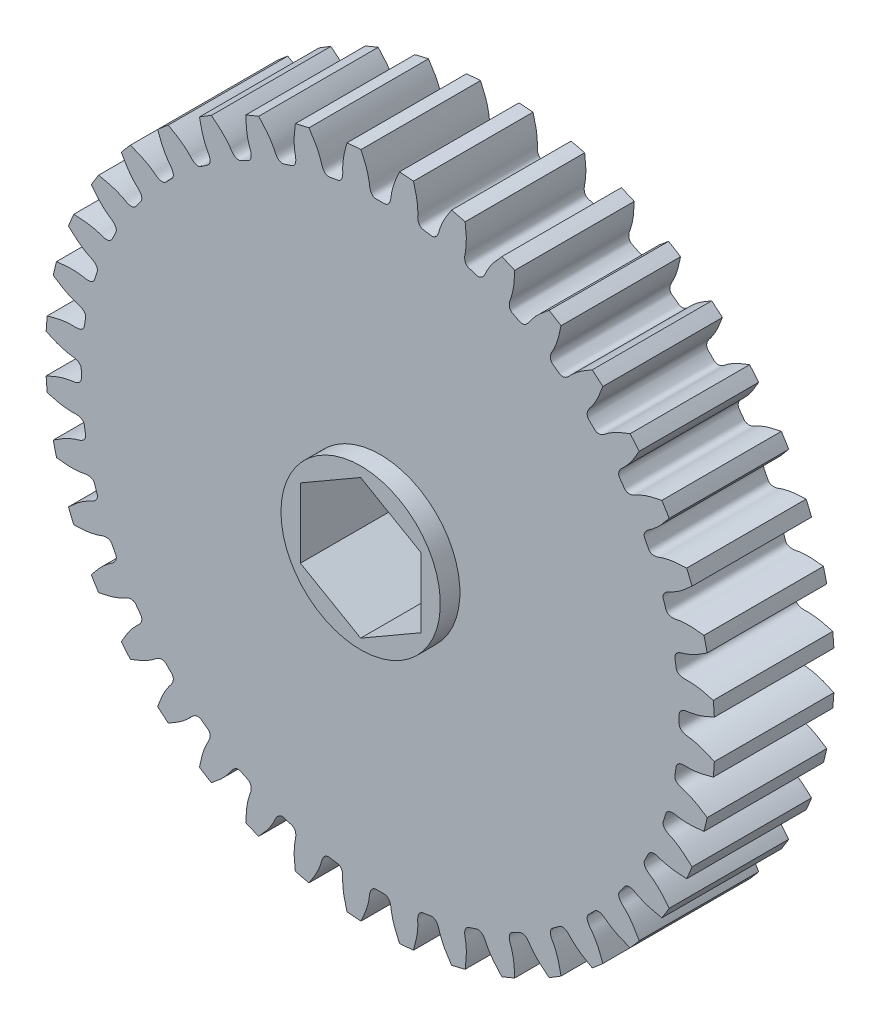
from build123d import *

# Parameters (mm, degrees)
BOSS_EXTRUDE1_DEPTH = 9.525
SKETCH2_R           = 6.35
BOSS_EXTRUDE2_DEPTH = 1.5621
BOSS_EXTRUDE3_START = 1.5621
SKETCH3_R           = 6.35
BOSS_EXTRUDE3_DEPTH = 1.5621
CUT_EXTRUDE1_DEPTH  = 40.722420689


with BuildPart() as part:
    # Sketch1 → Boss-Extrude1 (new body)
    with BuildSketch(Plane(origin=(0, 0, -4.7625), x_dir=(-1, 0, 0), z_dir=(0, 0, -1))):
        with BuildLine():
            ThreePointArc((-25.796844139, 6.768436486), (-25.933105777, 6.225987854), (-26.057962294, 5.680801095))
            add(Edge.make_bspline(
                [(-26.538058921, 2.649590288), (-26.346435583, 2.708405668), (-26.095635845, 2.777592561), (-25.787565675, 2.84804005), (-25.623095813, 2.882036671), (-25.468603865, 2.910607439), (-25.324240561, 2.934186764), (-25.190142623, 2.953213264), (-25.06643285, 2.968128812), (-24.953219968, 2.979378698), (-24.850598663, 2.987409714), (-24.758649208, 2.992674564), (-24.677438402, 2.995616326), (-24.607016458, 2.996714746), (-24.54742621, 2.996345626), (-24.481053639, 2.994767032), (-24.422080222, 2.990385038), (-24.36698261, 2.987604644), (-24.330087377, 2.986413555), (-24.294043161, 2.985903027), (-24.25881806, 2.986082526), (-24.22437529, 2.986955025), (-24.1906708, 2.988531322), (-24.157652377, 2.990828084), (-24.125258084, 2.993870672), (-24.093414571, 2.997695491), (-24.062035097, 3.002353509), (-24.031017368, 3.007914921), (-24.000241282, 3.014475479), (-23.969566905, 3.022165081), (-23.938833278, 3.031159397), (-23.90785924, 3.04169547), (-23.87644845, 3.054092242), (-23.844402438, 3.06877652), (-23.81154811, 3.08631336), (-23.77778938, 3.107435856), (-23.743196072, 3.133060919), (-23.708138554, 3.164262644), (-23.673470271, 3.202155715), (-23.640667386, 3.247631948), (-23.611960583, 3.30093819), (-23.590578681, 3.358597809), (-23.561503956, 3.501074849), (-23.536937958, 3.727884745), (-23.490213498, 3.951185086), (-23.473837378, 4.095673388), (-23.476354973, 4.157118315), (-23.48718423, 4.216686454), (-23.504328699, 4.27007357), (-23.525590593, 4.316825112), (-23.549290411, 4.357333084), (-23.574272021, 4.392393888), (-23.599851272, 4.422914596), (-23.625678413, 4.449745667), (-23.65161829, 4.473614008), (-23.677660913, 4.495110506), (-23.703863148, 4.514702412), (-23.730313168, 4.532753728), (-23.757110016, 4.549545878), (-23.784352489, 4.565295672), (-23.812133532, 4.580169895), (-23.840537778, 4.594296724), (-23.869640825, 4.60777453), (-23.899509416, 4.62067859), (-23.930202064, 4.633066195), (-23.961769837, 4.644980602), (-23.994257241, 4.656453799), (-24.027702834, 4.667509668), (-24.062140682, 4.678162403), (-24.097598201, 4.688430863), (-24.150858333, 4.70281265), (-24.208299496, 4.716868914), (-24.271911375, 4.735877835), (-24.328699133, 4.75394118), (-24.39533495, 4.776747417), (-24.471661963, 4.804640718), (-24.557484163, 4.838061832), (-24.652601103, 4.877411509), (-24.756796547, 4.923095491), (-24.869842375, 4.975509442), (-24.991497581, 5.035043262), (-25.121508829, 5.102079246), (-25.25961055, 5.176992299), (-25.405525151, 5.260148989), (-25.676747823, 5.42234745), (-25.893892621, 5.565649477), (-26.057962294, 5.680801095)],
                knots=[0, 0, 0, 0, 0.085621698, 0.111077756, 0.134991023, 0.157361498, 0.178189182, 0.197474075, 0.215216176, 0.231415486, 0.246072005, 0.259185732, 0.270756668, 0.280784812, 0.289270165, 0.296212727, 0.309141565, 0.314524909, 0.319779282, 0.324910023, 0.3299233, 0.334826267, 0.339627264, 0.344336062, 0.34896417, 0.353525211, 0.358035401, 0.362514142, 0.366984759, 0.37147542, 0.376020255, 0.380660689, 0.38544696, 0.390439674, 0.395711073, 0.401345277, 0.407436134, 0.414080402, 0.421363225, 0.429333468, 0.437970745, 0.447155355, 0.455484445, 0.5, 0.544515555, 0.552844645, 0.562029255, 0.570666532, 0.578636775, 0.585919598, 0.592563866, 0.598654723, 0.604288927, 0.609560326, 0.61455304, 0.619339311, 0.623979745, 0.62852458, 0.633015241, 0.637485858, 0.641964599, 0.646474789, 0.65103583, 0.655663938, 0.660372736, 0.665173733, 0.6700767, 0.675089977, 0.680220718, 0.685475091, 0.690858435, 0.703787273, 0.710729835, 0.719215188, 0.729243332, 0.740814268, 0.753927995, 0.768584514, 0.784783824, 0.802525925, 0.821810818, 0.842638502, 0.865008977, 0.888922244, 0.914378302, 1, 1, 1, 1], degree=3))
            ThreePointArc((-26.538058921, 2.649590288), (-26.587785291, 2.092504083), (-26.625818618, 1.534497615))
            add(Edge.make_bspline(
                [(-26.625818618, -1.534497615), (-26.445755233, -1.446429856), (-26.208866471, -1.338861045), (-25.915609572, -1.22108809), (-25.758482849, -1.161781269), (-25.610362406, -1.109394389), (-25.471465074, -1.063521969), (-25.341994504, -1.023752177), (-25.222141109, -0.989667792), (-25.112081935, -0.960846015), (-25.011980397, -0.936860365), (-24.921986596, -0.91727627), (-24.842235822, -0.901666557), (-24.772852721, -0.889565241), (-24.713938384, -0.880607849), (-24.648136023, -0.871784049), (-24.589203172, -0.866886619), (-24.534348953, -0.861013616), (-24.497721634, -0.856418355), (-24.462041319, -0.85128404), (-24.427277977, -0.84559633), (-24.393395743, -0.839346537), (-24.360352799, -0.832517104), (-24.32810018, -0.825083399), (-24.296580681, -0.817010686), (-24.265727547, -0.808251534), (-24.235463081, -0.798742033), (-24.205697228, -0.788396849), (-24.176326345, -0.777102622), (-24.147232539, -0.764709162), (-24.118284315, -0.751017783), (-24.089339823, -0.735766019), (-24.060255035, -0.718608142), (-24.03090069, -0.69909155), (-24.00119422, -0.676631069), (-23.971155401, -0.650487598), (-23.940996638, -0.619766436), (-23.911251761, -0.583464652), (-23.882938084, -0.540614792), (-23.857653107, -0.490566946), (-23.837638666, -0.433426259), (-23.825539963, -0.373131659), (-23.819111516, -0.227860459), (-23.83032885, 0), (-23.819111516, 0.227860459), (-23.825539963, 0.373131659), (-23.837638666, 0.433426259), (-23.857653107, 0.490566946), (-23.882938084, 0.540614792), (-23.911251761, 0.583464652), (-23.940996638, 0.619766436), (-23.971155401, 0.650487598), (-24.00119422, 0.676631069), (-24.03090069, 0.69909155), (-24.060255035, 0.718608142), (-24.089339823, 0.735766019), (-24.118284315, 0.751017783), (-24.147232539, 0.764709162), (-24.176326345, 0.777102622), (-24.205697228, 0.788396849), (-24.235463081, 0.798742033), (-24.265727547, 0.808251534), (-24.296580681, 0.817010686), (-24.32810018, 0.825083399), (-24.360352799, 0.832517104), (-24.393395743, 0.839346537), (-24.427277977, 0.84559633), (-24.462041319, 0.85128404), (-24.497721634, 0.856418355), (-24.534348953, 0.861013616), (-24.589203172, 0.866886619), (-24.648136023, 0.871784049), (-24.713938384, 0.880607849), (-24.772852721, 0.889565241), (-24.842235822, 0.901666557), (-24.921986596, 0.91727627), (-25.011980397, 0.936860365), (-25.112081935, 0.960846015), (-25.222141109, 0.989667792), (-25.341994504, 1.023752177), (-25.471465074, 1.063521969), (-25.610362406, 1.109394389), (-25.758482849, 1.161781269), (-25.915609572, 1.22108809), (-26.208866471, 1.338861045), (-26.445755233, 1.446429856), (-26.625818618, 1.534497615)],
                knots=[0, 0, 0, 0, 0.085621698, 0.111077756, 0.134991023, 0.157361498, 0.178189182, 0.197474075, 0.215216176, 0.231415486, 0.246072005, 0.259185732, 0.270756668, 0.280784812, 0.289270165, 0.296212727, 0.309141565, 0.314524909, 0.319779282, 0.324910023, 0.3299233, 0.334826267, 0.339627264, 0.344336062, 0.34896417, 0.353525211, 0.358035401, 0.362514142, 0.366984759, 0.37147542, 0.376020255, 0.380660689, 0.38544696, 0.390439674, 0.395711073, 0.401345277, 0.407436134, 0.414080402, 0.421363225, 0.429333468, 0.437970745, 0.447155355, 0.455484445, 0.5, 0.544515555, 0.552844645, 0.562029255, 0.570666532, 0.578636775, 0.585919598, 0.592563866, 0.598654723, 0.604288927, 0.609560326, 0.61455304, 0.619339311, 0.623979745, 0.62852458, 0.633015241, 0.637485858, 0.641964599, 0.646474789, 0.65103583, 0.655663938, 0.660372736, 0.665173733, 0.6700767, 0.675089977, 0.680220718, 0.685475091, 0.690858435, 0.703787273, 0.710729835, 0.719215188, 0.729243332, 0.740814268, 0.753927995, 0.768584514, 0.784783824, 0.802525925, 0.821810818, 0.842638502, 0.865008977, 0.888922244, 0.914378302, 1, 1, 1, 1], degree=3))
            ThreePointArc((-26.625818618, -1.534497615), (-26.587785291, -2.092504083), (-26.538058921, -2.649590288))
            add(Edge.make_bspline(
                [(-26.057962294, -5.680801095), (-25.893892621, -5.565649477), (-25.676747823, -5.42234745), (-25.405525151, -5.260148989), (-25.25961055, -5.176992299), (-25.121508829, -5.102079246), (-24.991497581, -5.035043262), (-24.869842375, -4.975509442), (-24.756796547, -4.923095491), (-24.652601103, -4.877411509), (-24.557484163, -4.838061832), (-24.471661963, -4.804640718), (-24.39533495, -4.776747417), (-24.328699133, -4.75394118), (-24.271911375, -4.735877835), (-24.208299496, -4.716868914), (-24.150858333, -4.70281265), (-24.097598201, -4.688430863), (-24.062140682, -4.678162403), (-24.027702834, -4.667509668), (-23.994257241, -4.656453799), (-23.961769837, -4.644980602), (-23.930202064, -4.633066195), (-23.899509416, -4.62067859), (-23.869640825, -4.60777453), (-23.840537778, -4.594296724), (-23.812133532, -4.580169895), (-23.784352489, -4.565295672), (-23.757110016, -4.549545878), (-23.730313168, -4.532753728), (-23.703863148, -4.514702412), (-23.677660913, -4.495110506), (-23.65161829, -4.473614008), (-23.625678413, -4.449745667), (-23.599851272, -4.422914596), (-23.574272021, -4.392393888), (-23.549290411, -4.357333084), (-23.525590593, -4.316825112), (-23.504328699, -4.27007357), (-23.48718423, -4.216686454), (-23.476354973, -4.157118315), (-23.473837378, -4.095673388), (-23.490213498, -3.951185086), (-23.536937958, -3.727884745), (-23.561503956, -3.501074849), (-23.590578681, -3.358597809), (-23.611960583, -3.30093819), (-23.640667386, -3.247631948), (-23.673470271, -3.202155715), (-23.708138554, -3.164262644), (-23.743196072, -3.133060919), (-23.77778938, -3.107435856), (-23.81154811, -3.08631336), (-23.844402438, -3.06877652), (-23.87644845, -3.054092242), (-23.90785924, -3.04169547), (-23.938833278, -3.031159397), (-23.969566905, -3.022165081), (-24.000241282, -3.014475479), (-24.031017368, -3.007914921), (-24.062035097, -3.002353509), (-24.093414571, -2.997695491), (-24.125258084, -2.993870672), (-24.157652377, -2.990828084), (-24.1906708, -2.988531322), (-24.22437529, -2.986955025), (-24.25881806, -2.986082526), (-24.294043161, -2.985903027), (-24.330087377, -2.986413555), (-24.36698261, -2.987604644), (-24.422080222, -2.990385038), (-24.481053639, -2.994767032), (-24.54742621, -2.996345626), (-24.607016458, -2.996714746), (-24.677438402, -2.995616326), (-24.758649208, -2.992674564), (-24.850598663, -2.987409714), (-24.953219968, -2.979378698), (-25.06643285, -2.968128812), (-25.190142623, -2.953213264), (-25.324240561, -2.934186764), (-25.468603865, -2.910607439), (-25.623095813, -2.882036671), (-25.787565675, -2.84804005), (-26.095635845, -2.777592561), (-26.346435583, -2.708405668), (-26.538058921, -2.649590288)],
                knots=[0, 0, 0, 0, 0.085621698, 0.111077756, 0.134991023, 0.157361498, 0.178189182, 0.197474075, 0.215216176, 0.231415486, 0.246072005, 0.259185732, 0.270756668, 0.280784812, 0.289270165, 0.296212727, 0.309141565, 0.314524909, 0.319779282, 0.324910023, 0.3299233, 0.334826267, 0.339627264, 0.344336062, 0.34896417, 0.353525211, 0.358035401, 0.362514142, 0.366984759, 0.37147542, 0.376020255, 0.380660689, 0.38544696, 0.390439674, 0.395711073, 0.401345277, 0.407436134, 0.414080402, 0.421363225, 0.429333468, 0.437970745, 0.447155355, 0.455484445, 0.5, 0.544515555, 0.552844645, 0.562029255, 0.570666532, 0.578636775, 0.585919598, 0.592563866, 0.598654723, 0.604288927, 0.609560326, 0.61455304, 0.619339311, 0.623979745, 0.62852458, 0.633015241, 0.637485858, 0.641964599, 0.646474789, 0.65103583, 0.655663938, 0.660372736, 0.665173733, 0.6700767, 0.675089977, 0.680220718, 0.685475091, 0.690858435, 0.703787273, 0.710729835, 0.719215188, 0.729243332, 0.740814268, 0.753927995, 0.768584514, 0.784783824, 0.802525925, 0.821810818, 0.842638502, 0.865008977, 0.888922244, 0.914378302, 1, 1, 1, 1], degree=3))
            ThreePointArc((-26.057962294, -5.680801095), (-25.933105777, -6.225987854), (-25.796844139, -6.768436486))
            add(Edge.make_bspline(
                [(-24.848472457, -9.687224398), (-24.704436436, -9.547824336), (-24.512382426, -9.372317665), (-24.269872385, -9.169687562), (-24.138762808, -9.064728596), (-24.014080331, -8.969133978), (-23.896156475, -8.882585078), (-23.785312188, -8.804753152), (-23.681857491, -8.73530024), (-23.586091415, -8.673878946), (-23.498301168, -8.620134161), (-23.418763795, -8.573698966), (-23.347739969, -8.534208902), (-23.28549223, -8.501259309), (-23.232229353, -8.474534791), (-23.172374293, -8.445808812), (-23.117839209, -8.422939826), (-23.067484605, -8.400403382), (-23.034069969, -8.384714566), (-23.001722563, -8.368805718), (-22.970418259, -8.352653921), (-22.940125632, -8.336239828), (-22.910810335, -8.31953382), (-22.882433413, -8.30249734), (-22.854951194, -8.285079672), (-22.828314846, -8.267215081), (-22.802470227, -8.248818774), (-22.777358056, -8.229781765), (-22.752914794, -8.209964215), (-22.72907473, -8.189186854), (-22.705774202, -8.167220084), (-22.682959409, -8.143770455), (-22.660600207, -8.118464651), (-22.638713524, -8.090832278), (-22.617401662, -8.060291287), (-22.596911825, -8.026144862), (-22.577722498, -7.987607731), (-22.560651307, -7.94389101), (-22.546964735, -7.894388965), (-22.538382928, -7.838977147), (-22.537005507, -7.778448322), (-22.544131012, -7.717366045), (-22.582908465, -7.577218424), (-22.663989538, -7.363976596), (-22.723733974, -7.143802075), (-22.77473906, -7.007627453), (-22.804877667, -6.954022585), (-22.841569974, -6.905863366), (-22.881083051, -6.866078522), (-22.921252294, -6.834075292), (-22.96075922, -6.808741916), (-22.99893527, -6.788843925), (-23.035582661, -6.773262512), (-23.070775863, -6.761081129), (-23.104724463, -6.751590739), (-23.137687816, -6.744260322), (-23.169928717, -6.738699372), (-23.201690984, -6.73462359), (-23.233190627, -6.73182719), (-23.264614105, -6.730161844), (-23.296119951, -6.729521144), (-23.327841766, -6.729829304), (-23.359891567, -6.731032999), (-23.392362997, -6.733095453), (-23.425334201, -6.735992187), (-23.45887032, -6.739707842), (-23.493025532, -6.744234121), (-23.527845034, -6.749567251), (-23.563365621, -6.755710051), (-23.599620285, -6.762658163), (-23.653604604, -6.77402349), (-23.711166466, -6.78757701), (-23.776474934, -6.799519126), (-23.835273785, -6.80920567), (-23.905000548, -6.819137193), (-23.985671707, -6.828935818), (-24.077312716, -6.838119851), (-24.17992691, -6.846241219), (-24.293505824, -6.852840235), (-24.41802583, -6.857460794), (-24.5534492, -6.85964608), (-24.699723771, -6.858940453), (-24.85678312, -6.854889303), (-25.024546328, -6.847039992), (-25.339844058, -6.825652621), (-25.59837925, -6.796551256), (-25.796844139, -6.768436486)],
                knots=[0, 0, 0, 0, 0.085621698, 0.111077756, 0.134991023, 0.157361498, 0.178189182, 0.197474075, 0.215216176, 0.231415486, 0.246072005, 0.259185732, 0.270756668, 0.280784812, 0.289270165, 0.296212727, 0.309141565, 0.314524909, 0.319779282, 0.324910023, 0.3299233, 0.334826267, 0.339627264, 0.344336062, 0.34896417, 0.353525211, 0.358035401, 0.362514142, 0.366984759, 0.37147542, 0.376020255, 0.380660689, 0.38544696, 0.390439674, 0.395711073, 0.401345277, 0.407436134, 0.414080402, 0.421363225, 0.429333468, 0.437970745, 0.447155355, 0.455484445, 0.5, 0.544515555, 0.552844645, 0.562029255, 0.570666532, 0.578636775, 0.585919598, 0.592563866, 0.598654723, 0.604288927, 0.609560326, 0.61455304, 0.619339311, 0.623979745, 0.62852458, 0.633015241, 0.637485858, 0.641964599, 0.646474789, 0.65103583, 0.655663938, 0.660372736, 0.665173733, 0.6700767, 0.675089977, 0.680220718, 0.685475091, 0.690858435, 0.703787273, 0.710729835, 0.719215188, 0.729243332, 0.740814268, 0.753927995, 0.768584514, 0.784783824, 0.802525925, 0.821810818, 0.842638502, 0.865008977, 0.888922244, 0.914378302, 1, 1, 1, 1], degree=3))
            ThreePointArc((-24.848472457, -9.687224398), (-24.639867132, -10.206167141), (-24.42042544, -10.720621314))
            add(Edge.make_bspline(
                [(-23.027130761, -13.455116087), (-22.906675037, -13.294900073), (-22.744440822, -13.091510313), (-22.536614814, -12.853437995), (-22.423538613, -12.729261192), (-22.315345477, -12.615338866), (-22.212412691, -12.511408171), (-22.115108677, -12.417194618), (-22.023792507, -12.332412906), (-21.938813878, -12.256766695), (-21.860512011, -12.189950177), (-21.789217941, -12.13164429), (-21.725246142, -12.081529841), (-21.668919229, -12.039248221), (-21.620492742, -12.004520576), (-21.565868329, -11.966784866), (-21.515582161, -11.935666269), (-21.469372982, -11.905530091), (-21.438824007, -11.884807229), (-21.409363543, -11.864033997), (-21.380971345, -11.843183983), (-21.353619401, -11.822233164), (-21.327278419, -11.801146912), (-21.301915957, -11.77988105), (-21.277496812, -11.758378657), (-21.253983041, -11.736567166), (-21.231334428, -11.714354358), (-21.209509474, -11.691623317), (-21.188467296, -11.668225985), (-21.168171039, -11.643975021), (-21.148593738, -11.618633693), (-21.129728164, -11.591903748), (-21.111602941, -11.56341175), (-21.094308374, -11.532695746), (-21.078036561, -11.499196855), (-21.063140665, -11.462265514), (-21.050216126, -11.421200966), (-21.040193912, -11.375351948), (-21.03441967, -11.324318303), (-21.034611838, -11.268246206), (-21.042720169, -11.208247116), (-21.059313321, -11.149031537), (-21.119537277, -11.016675496), (-21.232978479, -10.818742904), (-21.326430245, -10.610625185), (-21.398109778, -10.484106052), (-21.436262977, -10.435875866), (-21.480037303, -10.394049508), (-21.525287629, -10.360935689), (-21.56996873, -10.335610325), (-21.612952274, -10.31676909), (-21.653771045, -10.303088127), (-21.692404715, -10.293431461), (-21.729070219, -10.286905481), (-21.764085479, -10.282842665), (-21.797789729, -10.280759102), (-21.830503615, -10.280310205), (-21.862512428, -10.281253315), (-21.894061712, -10.283418973), (-21.925358833, -10.286689845), (-21.956577017, -10.290985633), (-21.987860077, -10.296252385), (-22.019326992, -10.302454954), (-22.051076006, -10.309571667), (-22.083188131, -10.31759057), (-22.115730108, -10.326506683), (-22.148756746, -10.336320289), (-22.182313277, -10.347034729), (-22.216435601, -10.358658545), (-22.251156986, -10.371192593), (-22.30269874, -10.390863003), (-22.357431682, -10.413254315), (-22.420067936, -10.435265899), (-22.476627566, -10.454031353), (-22.543942244, -10.474748271), (-22.622087365, -10.497046008), (-22.711163422, -10.520452782), (-22.811243803, -10.544526559), (-22.922392058, -10.568811987), (-23.044656202, -10.59285488), (-23.178070432, -10.616198145), (-23.322654504, -10.638383589), (-23.478413931, -10.658951811), (-23.645339599, -10.677443085), (-23.960101213, -10.70564246), (-24.220005863, -10.717343196), (-24.42042544, -10.720621314)],
                knots=[0, 0, 0, 0, 0.085621698, 0.111077756, 0.134991023, 0.157361498, 0.178189182, 0.197474075, 0.215216176, 0.231415486, 0.246072005, 0.259185732, 0.270756668, 0.280784812, 0.289270165, 0.296212727, 0.309141565, 0.314524909, 0.319779282, 0.324910023, 0.3299233, 0.334826267, 0.339627264, 0.344336062, 0.34896417, 0.353525211, 0.358035401, 0.362514142, 0.366984759, 0.37147542, 0.376020255, 0.380660689, 0.38544696, 0.390439674, 0.395711073, 0.401345277, 0.407436134, 0.414080402, 0.421363225, 0.429333468, 0.437970745, 0.447155355, 0.455484445, 0.5, 0.544515555, 0.552844645, 0.562029255, 0.570666532, 0.578636775, 0.585919598, 0.592563866, 0.598654723, 0.604288927, 0.609560326, 0.61455304, 0.619339311, 0.623979745, 0.62852458, 0.633015241, 0.637485858, 0.641964599, 0.646474789, 0.65103583, 0.655663938, 0.660372736, 0.665173733, 0.6700767, 0.675089977, 0.680220718, 0.685475091, 0.690858435, 0.703787273, 0.710729835, 0.719215188, 0.729243332, 0.740814268, 0.753927995, 0.768584514, 0.784783824, 0.802525925, 0.821810818, 0.842638502, 0.865008977, 0.888922244, 0.914378302, 1, 1, 1, 1], degree=3))
            ThreePointArc((-23.027130761, -13.455116087), (-22.739913183, -13.935036721), (-22.442694819, -14.408828865))
            add(Edge.make_bspline(
                [(-20.638784683, -16.891698162), (-20.544875275, -16.714611246), (-20.416455601, -16.48834653), (-20.248430992, -16.220694127), (-20.156172478, -16.080357131), (-20.067132758, -15.950912242), (-19.981725587, -15.832158872), (-19.900357794, -15.723883542), (-19.823428659, -15.625860638), (-19.751329932, -15.537852171), (-19.684444498, -15.459609165), (-19.623149226, -15.39086827), (-19.567804654, -15.331363418), (-19.518785521, -15.280790885), (-19.476387845, -15.238915223), (-19.428339115, -15.193098962), (-19.383540074, -15.154496997), (-19.342614144, -15.117503137), (-19.315683047, -15.092256495), (-19.28983494, -15.067130384), (-19.265053957, -15.04209555), (-19.241316191, -15.017123884), (-19.218598127, -14.992176601), (-19.196874633, -14.967204994), (-19.176119844, -14.942147335), (-19.156307634, -14.916926015), (-19.137412712, -14.89144366), (-19.119412378, -14.865578302), (-19.102289414, -14.839177308), (-19.086036723, -14.812049878), (-19.070664709, -14.78395798), (-19.056212886, -14.754605899), (-19.042767945, -14.723629275), (-19.030491345, -14.69058597), (-19.019660245, -14.654954034), (-19.010725078, -14.616147147), (-19.004383572, -14.573566328), (-19.001657114, -14.526713968), (-19.003937383, -14.475405342), (-19.012898794, -14.420053647), (-19.030293224, -14.362061667), (-19.055945444, -14.306170871), (-19.13613299, -14.184865455), (-19.279141021, -14.007115855), (-19.403999025, -13.816179488), (-19.494588016, -13.702431165), (-19.53981635, -13.660763248), (-19.589594826, -13.626299655), (-19.639468188, -13.600672233), (-19.687560949, -13.58264833), (-19.732962713, -13.57076317), (-19.775419111, -13.563636104), (-19.815087773, -13.560141966), (-19.852322751, -13.55943208), (-19.88754248, -13.560896877), (-19.921157715, -13.564111473), (-19.953539063, -13.568785682), (-19.985006259, -13.574724462), (-20.015828335, -13.581798852), (-20.046228459, -13.589925403), (-20.076390287, -13.599051903), (-20.106464298, -13.609147561), (-20.136573508, -13.620196276), (-20.16681834, -13.63219201), (-20.197280679, -13.645135631), (-20.228027223, -13.659032659), (-20.259112062, -13.673891947), (-20.290579348, -13.689723873), (-20.322463205, -13.706542488), (-20.354796354, -13.724353842), (-20.402626414, -13.751844983), (-20.45318273, -13.782522739), (-20.511604457, -13.814061794), (-20.56453218, -13.841444089), (-20.627777263, -13.872436282), (-20.701472154, -13.906684088), (-20.78578991, -13.943737251), (-20.880872167, -13.983170661), (-20.986852925, -14.024544513), (-21.103850657, -14.067417724), (-21.231970645, -14.111344178), (-21.371304079, -14.155874414), (-21.521928271, -14.20055555), (-21.683906134, -14.244932094), (-21.990381156, -14.322023852), (-22.245255551, -14.374238577), (-22.442694819, -14.408828865)],
                knots=[0, 0, 0, 0, 0.085621698, 0.111077756, 0.134991023, 0.157361498, 0.178189182, 0.197474075, 0.215216176, 0.231415486, 0.246072005, 0.259185732, 0.270756668, 0.280784812, 0.289270165, 0.296212727, 0.309141565, 0.314524909, 0.319779282, 0.324910023, 0.3299233, 0.334826267, 0.339627264, 0.344336062, 0.34896417, 0.353525211, 0.358035401, 0.362514142, 0.366984759, 0.37147542, 0.376020255, 0.380660689, 0.38544696, 0.390439674, 0.395711073, 0.401345277, 0.407436134, 0.414080402, 0.421363225, 0.429333468, 0.437970745, 0.447155355, 0.455484445, 0.5, 0.544515555, 0.552844645, 0.562029255, 0.570666532, 0.578636775, 0.585919598, 0.592563866, 0.598654723, 0.604288927, 0.609560326, 0.61455304, 0.619339311, 0.623979745, 0.62852458, 0.633015241, 0.637485858, 0.641964599, 0.646474789, 0.65103583, 0.655663938, 0.660372736, 0.665173733, 0.6700767, 0.675089977, 0.680220718, 0.685475091, 0.690858435, 0.703787273, 0.710729835, 0.719215188, 0.729243332, 0.740814268, 0.753927995, 0.768584514, 0.784783824, 0.802525925, 0.821810818, 0.842638502, 0.865008977, 0.888922244, 0.914378302, 1, 1, 1, 1], degree=3))
            ThreePointArc((-20.638784683, -16.891698162), (-20.280027103, -17.320779449), (-19.912350569, -17.74224323))
            add(Edge.make_bspline(
                [(-17.74224323, -19.912350569), (-17.677192499, -19.722753219), (-17.585749485, -19.479184933), (-17.461663598, -19.188542936), (-17.392494482, -19.03550131), (-17.32480063, -18.893721221), (-17.259022084, -18.763069277), (-17.195594056, -18.643398269), (-17.134946208, -18.534547822), (-17.077502693, -18.436344159), (-17.023680633, -18.348601267), (-16.973893452, -18.271117993), (-16.928538873, -18.203687947), (-16.888034534, -18.146069763), (-16.85270964, -18.098077203), (-16.812419712, -18.045308539), (-16.7742109, -18.000173713), (-16.73957595, -17.957233083), (-16.716925865, -17.928084318), (-16.695326581, -17.899224016), (-16.674767004, -17.870620803), (-16.655227918, -17.842243174), (-16.636692167, -17.814049145), (-16.619142544, -17.785986677), (-16.602563163, -17.757990755), (-16.586940358, -17.72998064), (-16.572264382, -17.701856198), (-16.558531895, -17.673493412), (-16.545749769, -17.644738836), (-16.533940841, -17.61540291), (-16.523152623, -17.585252157), (-16.513470402, -17.554000685), (-16.505036802, -17.521302182), (-16.49808046, -17.486745212), (-16.492956772, -17.449857607), (-16.490202346, -17.410130729), (-16.490600022, -17.367082121), (-16.495236455, -17.320380079), (-16.505515088, -17.27005986), (-16.523025081, -17.216791509), (-16.549277301, -17.162234596), (-16.583356947, -17.1110448), (-16.681533599, -17.00377695), (-16.850587128, -16.850587128), (-17.00377695, -16.681533599), (-17.1110448, -16.583356947), (-17.162234596, -16.549277301), (-17.216791509, -16.523025081), (-17.27005986, -16.505515088), (-17.320380079, -16.495236455), (-17.367082121, -16.490600022), (-17.410130729, -16.490202346), (-17.449857607, -16.492956772), (-17.486745212, -16.49808046), (-17.521302182, -16.505036802), (-17.554000685, -16.513470402), (-17.585252157, -16.523152623), (-17.61540291, -16.533940841), (-17.644738836, -16.545749769), (-17.673493412, -16.558531895), (-17.701856198, -16.572264382), (-17.72998064, -16.586940358), (-17.757990755, -16.602563163), (-17.785986677, -16.619142544), (-17.814049145, -16.636692167), (-17.842243174, -16.655227918), (-17.870620803, -16.674767004), (-17.899224016, -16.695326581), (-17.928084318, -16.716925865), (-17.957233083, -16.73957595), (-18.000173713, -16.7742109), (-18.045308539, -16.812419712), (-18.098077203, -16.85270964), (-18.146069763, -16.888034534), (-18.203687947, -16.928538873), (-18.271117993, -16.973893452), (-18.348601267, -17.023680633), (-18.436344159, -17.077502693), (-18.534547822, -17.134946208), (-18.643398269, -17.195594056), (-18.763069277, -17.259022084), (-18.893721221, -17.32480063), (-19.03550131, -17.392494482), (-19.188542936, -17.461663598), (-19.479184933, -17.585749485), (-19.722753219, -17.677192499), (-19.912350569, -17.74224323)],
                knots=[0, 0, 0, 0, 0.085621698, 0.111077756, 0.134991023, 0.157361498, 0.178189182, 0.197474075, 0.215216176, 0.231415486, 0.246072005, 0.259185732, 0.270756668, 0.280784812, 0.289270165, 0.296212727, 0.309141565, 0.314524909, 0.319779282, 0.324910023, 0.3299233, 0.334826267, 0.339627264, 0.344336062, 0.34896417, 0.353525211, 0.358035401, 0.362514142, 0.366984759, 0.37147542, 0.376020255, 0.380660689, 0.38544696, 0.390439674, 0.395711073, 0.401345277, 0.407436134, 0.414080402, 0.421363225, 0.429333468, 0.437970745, 0.447155355, 0.455484445, 0.5, 0.544515555, 0.552844645, 0.562029255, 0.570666532, 0.578636775, 0.585919598, 0.592563866, 0.598654723, 0.604288927, 0.609560326, 0.61455304, 0.619339311, 0.623979745, 0.62852458, 0.633015241, 0.637485858, 0.641964599, 0.646474789, 0.65103583, 0.655663938, 0.660372736, 0.665173733, 0.6700767, 0.675089977, 0.680220718, 0.685475091, 0.690858435, 0.703787273, 0.710729835, 0.719215188, 0.729243332, 0.740814268, 0.753927995, 0.768584514, 0.784783824, 0.802525925, 0.821810818, 0.842638502, 0.865008977, 0.888922244, 0.914378302, 1, 1, 1, 1], degree=3))
            ThreePointArc((-17.74224323, -19.912350569), (-17.320779449, -20.280027103), (-16.891698162, -20.638784683))
            add(Edge.make_bspline(
                [(-14.408828865, -22.442694819), (-14.374238577, -22.245255551), (-14.322023852, -21.990381156), (-14.244932094, -21.683906134), (-14.20055555, -21.521928271), (-14.155874414, -21.371304079), (-14.111344178, -21.231970645), (-14.067417724, -21.103850657), (-14.024544513, -20.986852925), (-13.983170661, -20.880872167), (-13.943737251, -20.78578991), (-13.906684088, -20.701472154), (-13.872436282, -20.627777263), (-13.841444089, -20.56453218), (-13.814061794, -20.511604457), (-13.782522739, -20.45318273), (-13.751844983, -20.402626414), (-13.724353842, -20.354796354), (-13.706542488, -20.322463205), (-13.689723873, -20.290579348), (-13.673891947, -20.259112062), (-13.659032659, -20.228027223), (-13.645135631, -20.197280679), (-13.63219201, -20.16681834), (-13.620196276, -20.136573508), (-13.609147561, -20.106464298), (-13.599051903, -20.076390287), (-13.589925403, -20.046228459), (-13.581798852, -20.015828335), (-13.574724462, -19.985006259), (-13.568785682, -19.953539063), (-13.564111473, -19.921157715), (-13.560896877, -19.88754248), (-13.55943208, -19.852322751), (-13.560141966, -19.815087773), (-13.563636104, -19.775419111), (-13.57076317, -19.732962713), (-13.58264833, -19.687560949), (-13.600672233, -19.639468188), (-13.626299655, -19.589594826), (-13.660763248, -19.53981635), (-13.702431165, -19.494588016), (-13.816179488, -19.403999025), (-14.007115855, -19.279141021), (-14.184865455, -19.13613299), (-14.306170871, -19.055945444), (-14.362061667, -19.030293224), (-14.420053647, -19.012898794), (-14.475405342, -19.003937383), (-14.526713968, -19.001657114), (-14.573566328, -19.004383572), (-14.616147147, -19.010725078), (-14.654954034, -19.019660245), (-14.69058597, -19.030491345), (-14.723629275, -19.042767945), (-14.754605899, -19.056212886), (-14.78395798, -19.070664709), (-14.812049878, -19.086036723), (-14.839177308, -19.102289414), (-14.865578302, -19.119412378), (-14.89144366, -19.137412712), (-14.916926015, -19.156307634), (-14.942147335, -19.176119844), (-14.967204994, -19.196874633), (-14.992176601, -19.218598127), (-15.017123884, -19.241316191), (-15.04209555, -19.265053957), (-15.067130384, -19.28983494), (-15.092256495, -19.315683047), (-15.117503137, -19.342614144), (-15.154496997, -19.383540074), (-15.193098962, -19.428339115), (-15.238915223, -19.476387845), (-15.280790885, -19.518785521), (-15.331363418, -19.567804654), (-15.39086827, -19.623149226), (-15.459609165, -19.684444498), (-15.537852171, -19.751329932), (-15.625860638, -19.823428659), (-15.723883542, -19.900357794), (-15.832158872, -19.981725587), (-15.950912242, -20.067132758), (-16.080357131, -20.156172478), (-16.220694127, -20.248430992), (-16.48834653, -20.416455601), (-16.714611246, -20.544875275), (-16.891698162, -20.638784683)],
                knots=[0, 0, 0, 0, 0.085621698, 0.111077756, 0.134991023, 0.157361498, 0.178189182, 0.197474075, 0.215216176, 0.231415486, 0.246072005, 0.259185732, 0.270756668, 0.280784812, 0.289270165, 0.296212727, 0.309141565, 0.314524909, 0.319779282, 0.324910023, 0.3299233, 0.334826267, 0.339627264, 0.344336062, 0.34896417, 0.353525211, 0.358035401, 0.362514142, 0.366984759, 0.37147542, 0.376020255, 0.380660689, 0.38544696, 0.390439674, 0.395711073, 0.401345277, 0.407436134, 0.414080402, 0.421363225, 0.429333468, 0.437970745, 0.447155355, 0.455484445, 0.5, 0.544515555, 0.552844645, 0.562029255, 0.570666532, 0.578636775, 0.585919598, 0.592563866, 0.598654723, 0.604288927, 0.609560326, 0.61455304, 0.619339311, 0.623979745, 0.62852458, 0.633015241, 0.637485858, 0.641964599, 0.646474789, 0.65103583, 0.655663938, 0.660372736, 0.665173733, 0.6700767, 0.675089977, 0.680220718, 0.685475091, 0.690858435, 0.703787273, 0.710729835, 0.719215188, 0.729243332, 0.740814268, 0.753927995, 0.768584514, 0.784783824, 0.802525925, 0.821810818, 0.842638502, 0.865008977, 0.888922244, 0.914378302, 1, 1, 1, 1], degree=3))
            ThreePointArc((-14.408828865, -22.442694819), (-13.935036721, -22.739913183), (-13.455116087, -23.027130761))
            add(Edge.make_bspline(
                [(-10.720621314, -24.42042544), (-10.717343196, -24.220005863), (-10.70564246, -23.960101213), (-10.677443085, -23.645339599), (-10.658951811, -23.478413931), (-10.638383589, -23.322654504), (-10.616198145, -23.178070432), (-10.59285488, -23.044656202), (-10.568811987, -22.922392058), (-10.544526559, -22.811243803), (-10.520452782, -22.711163422), (-10.497046008, -22.622087365), (-10.474748271, -22.543942244), (-10.454031353, -22.476627566), (-10.435265899, -22.420067936), (-10.413254315, -22.357431682), (-10.390863003, -22.30269874), (-10.371192593, -22.251156986), (-10.358658545, -22.216435601), (-10.347034729, -22.182313277), (-10.336320289, -22.148756746), (-10.326506683, -22.115730108), (-10.31759057, -22.083188131), (-10.309571667, -22.051076006), (-10.302454954, -22.019326992), (-10.296252385, -21.987860077), (-10.290985633, -21.956577017), (-10.286689845, -21.925358833), (-10.283418973, -21.894061712), (-10.281253315, -21.862512428), (-10.280310205, -21.830503615), (-10.280759102, -21.797789729), (-10.282842665, -21.764085479), (-10.286905481, -21.729070219), (-10.293431461, -21.692404715), (-10.303088127, -21.653771045), (-10.31676909, -21.612952274), (-10.335610325, -21.56996873), (-10.360935689, -21.525287629), (-10.394049508, -21.480037303), (-10.435875866, -21.436262977), (-10.484106052, -21.398109778), (-10.610625185, -21.326430245), (-10.818742904, -21.232978479), (-11.016675496, -21.119537277), (-11.149031537, -21.059313321), (-11.208247116, -21.042720169), (-11.268246206, -21.034611838), (-11.324318303, -21.03441967), (-11.375351948, -21.040193912), (-11.421200966, -21.050216126), (-11.462265514, -21.063140665), (-11.499196855, -21.078036561), (-11.532695746, -21.094308374), (-11.56341175, -21.111602941), (-11.591903748, -21.129728164), (-11.618633693, -21.148593738), (-11.643975021, -21.168171039), (-11.668225985, -21.188467296), (-11.691623317, -21.209509474), (-11.714354358, -21.231334428), (-11.736567166, -21.253983041), (-11.758378657, -21.277496812), (-11.77988105, -21.301915957), (-11.801146912, -21.327278419), (-11.822233164, -21.353619401), (-11.843183983, -21.380971345), (-11.864033997, -21.409363543), (-11.884807229, -21.438824007), (-11.905530091, -21.469372982), (-11.935666269, -21.515582161), (-11.966784866, -21.565868329), (-12.004520576, -21.620492742), (-12.039248221, -21.668919229), (-12.081529841, -21.725246142), (-12.13164429, -21.789217941), (-12.189950177, -21.860512011), (-12.256766695, -21.938813878), (-12.332412906, -22.023792507), (-12.417194618, -22.115108677), (-12.511408171, -22.212412691), (-12.615338866, -22.315345477), (-12.729261192, -22.423538613), (-12.853437995, -22.536614814), (-13.091510313, -22.744440822), (-13.294900073, -22.906675037), (-13.455116087, -23.027130761)],
                knots=[0, 0, 0, 0, 0.085621698, 0.111077756, 0.134991023, 0.157361498, 0.178189182, 0.197474075, 0.215216176, 0.231415486, 0.246072005, 0.259185732, 0.270756668, 0.280784812, 0.289270165, 0.296212727, 0.309141565, 0.314524909, 0.319779282, 0.324910023, 0.3299233, 0.334826267, 0.339627264, 0.344336062, 0.34896417, 0.353525211, 0.358035401, 0.362514142, 0.366984759, 0.37147542, 0.376020255, 0.380660689, 0.38544696, 0.390439674, 0.395711073, 0.401345277, 0.407436134, 0.414080402, 0.421363225, 0.429333468, 0.437970745, 0.447155355, 0.455484445, 0.5, 0.544515555, 0.552844645, 0.562029255, 0.570666532, 0.578636775, 0.585919598, 0.592563866, 0.598654723, 0.604288927, 0.609560326, 0.61455304, 0.619339311, 0.623979745, 0.62852458, 0.633015241, 0.637485858, 0.641964599, 0.646474789, 0.65103583, 0.655663938, 0.660372736, 0.665173733, 0.6700767, 0.675089977, 0.680220718, 0.685475091, 0.690858435, 0.703787273, 0.710729835, 0.719215188, 0.729243332, 0.740814268, 0.753927995, 0.768584514, 0.784783824, 0.802525925, 0.821810818, 0.842638502, 0.865008977, 0.888922244, 0.914378302, 1, 1, 1, 1], degree=3))
            ThreePointArc((-10.720621314, -24.42042544), (-10.206167141, -24.639867132), (-9.687224398, -24.848472457))
            add(Edge.make_bspline(
                [(-6.768436486, -25.796844139), (-6.796551256, -25.59837925), (-6.825652621, -25.339844058), (-6.847039992, -25.024546328), (-6.854889303, -24.85678312), (-6.858940453, -24.699723771), (-6.85964608, -24.5534492), (-6.857460794, -24.41802583), (-6.852840235, -24.293505824), (-6.846241219, -24.17992691), (-6.838119851, -24.077312716), (-6.828935818, -23.985671707), (-6.819137193, -23.905000548), (-6.80920567, -23.835273785), (-6.799519126, -23.776474934), (-6.78757701, -23.711166466), (-6.77402349, -23.653604604), (-6.762658163, -23.599620285), (-6.755710051, -23.563365621), (-6.749567251, -23.527845034), (-6.744234121, -23.493025532), (-6.739707842, -23.45887032), (-6.735992187, -23.425334201), (-6.733095453, -23.392362997), (-6.731032999, -23.359891567), (-6.729829304, -23.327841766), (-6.729521144, -23.296119951), (-6.730161844, -23.264614105), (-6.73182719, -23.233190627), (-6.73462359, -23.201690984), (-6.738699372, -23.169928717), (-6.744260322, -23.137687816), (-6.751590739, -23.104724463), (-6.761081129, -23.070775863), (-6.773262512, -23.035582661), (-6.788843925, -22.99893527), (-6.808741916, -22.96075922), (-6.834075292, -22.921252294), (-6.866078522, -22.881083051), (-6.905863366, -22.841569974), (-6.954022585, -22.804877667), (-7.007627453, -22.77473906), (-7.143802075, -22.723733974), (-7.363976596, -22.663989538), (-7.577218424, -22.582908465), (-7.717366045, -22.544131012), (-7.778448322, -22.537005507), (-7.838977147, -22.538382928), (-7.894388965, -22.546964735), (-7.94389101, -22.560651307), (-7.987607731, -22.577722498), (-8.026144862, -22.596911825), (-8.060291287, -22.617401662), (-8.090832278, -22.638713524), (-8.118464651, -22.660600207), (-8.143770455, -22.682959409), (-8.167220084, -22.705774202), (-8.189186854, -22.72907473), (-8.209964215, -22.752914794), (-8.229781765, -22.777358056), (-8.248818774, -22.802470227), (-8.267215081, -22.828314846), (-8.285079672, -22.854951194), (-8.30249734, -22.882433413), (-8.31953382, -22.910810335), (-8.336239828, -22.940125632), (-8.352653921, -22.970418259), (-8.368805718, -23.001722563), (-8.384714566, -23.034069969), (-8.400403382, -23.067484605), (-8.422939826, -23.117839209), (-8.445808812, -23.172374293), (-8.474534791, -23.232229353), (-8.501259309, -23.28549223), (-8.534208902, -23.347739969), (-8.573698966, -23.418763795), (-8.620134161, -23.498301168), (-8.673878946, -23.586091415), (-8.73530024, -23.681857491), (-8.804753152, -23.785312188), (-8.882585078, -23.896156475), (-8.969133978, -24.014080331), (-9.064728596, -24.138762808), (-9.169687562, -24.269872385), (-9.372317665, -24.512382426), (-9.547824336, -24.704436436), (-9.687224398, -24.848472457)],
                knots=[0, 0, 0, 0, 0.085621698, 0.111077756, 0.134991023, 0.157361498, 0.178189182, 0.197474075, 0.215216176, 0.231415486, 0.246072005, 0.259185732, 0.270756668, 0.280784812, 0.289270165, 0.296212727, 0.309141565, 0.314524909, 0.319779282, 0.324910023, 0.3299233, 0.334826267, 0.339627264, 0.344336062, 0.34896417, 0.353525211, 0.358035401, 0.362514142, 0.366984759, 0.37147542, 0.376020255, 0.380660689, 0.38544696, 0.390439674, 0.395711073, 0.401345277, 0.407436134, 0.414080402, 0.421363225, 0.429333468, 0.437970745, 0.447155355, 0.455484445, 0.5, 0.544515555, 0.552844645, 0.562029255, 0.570666532, 0.578636775, 0.585919598, 0.592563866, 0.598654723, 0.604288927, 0.609560326, 0.61455304, 0.619339311, 0.623979745, 0.62852458, 0.633015241, 0.637485858, 0.641964599, 0.646474789, 0.65103583, 0.655663938, 0.660372736, 0.665173733, 0.6700767, 0.675089977, 0.680220718, 0.685475091, 0.690858435, 0.703787273, 0.710729835, 0.719215188, 0.729243332, 0.740814268, 0.753927995, 0.768584514, 0.784783824, 0.802525925, 0.821810818, 0.842638502, 0.865008977, 0.888922244, 0.914378302, 1, 1, 1, 1], degree=3))
            ThreePointArc((-6.768436486, -25.796844139), (-6.225987854, -25.933105777), (-5.680801095, -26.057962294))
            add(Edge.make_bspline(
                [(-2.649590288, -26.538058921), (-2.708405668, -26.346435583), (-2.777592561, -26.095635845), (-2.84804005, -25.787565675), (-2.882036671, -25.623095813), (-2.910607439, -25.468603865), (-2.934186764, -25.324240561), (-2.953213264, -25.190142623), (-2.968128812, -25.06643285), (-2.979378698, -24.953219968), (-2.987409714, -24.850598663), (-2.992674564, -24.758649208), (-2.995616326, -24.677438402), (-2.996714746, -24.607016458), (-2.996345626, -24.54742621), (-2.994767032, -24.481053639), (-2.990385038, -24.422080222), (-2.987604644, -24.36698261), (-2.986413555, -24.330087377), (-2.985903027, -24.294043161), (-2.986082526, -24.25881806), (-2.986955025, -24.22437529), (-2.988531322, -24.1906708), (-2.990828084, -24.157652377), (-2.993870672, -24.125258084), (-2.997695491, -24.093414571), (-3.002353509, -24.062035097), (-3.007914921, -24.031017368), (-3.014475479, -24.000241282), (-3.022165081, -23.969566905), (-3.031159397, -23.938833278), (-3.04169547, -23.90785924), (-3.054092242, -23.87644845), (-3.06877652, -23.844402438), (-3.08631336, -23.81154811), (-3.107435856, -23.77778938), (-3.133060919, -23.743196072), (-3.164262644, -23.708138554), (-3.202155715, -23.673470271), (-3.247631948, -23.640667386), (-3.30093819, -23.611960583), (-3.358597809, -23.590578681), (-3.501074849, -23.561503956), (-3.727884745, -23.536937958), (-3.951185086, -23.490213498), (-4.095673388, -23.473837378), (-4.157118315, -23.476354973), (-4.216686454, -23.48718423), (-4.27007357, -23.504328699), (-4.316825112, -23.525590593), (-4.357333084, -23.549290411), (-4.392393888, -23.574272021), (-4.422914596, -23.599851272), (-4.449745667, -23.625678413), (-4.473614008, -23.65161829), (-4.495110506, -23.677660913), (-4.514702412, -23.703863148), (-4.532753728, -23.730313168), (-4.549545878, -23.757110016), (-4.565295672, -23.784352489), (-4.580169895, -23.812133532), (-4.594296724, -23.840537778), (-4.60777453, -23.869640825), (-4.62067859, -23.899509416), (-4.633066195, -23.930202064), (-4.644980602, -23.961769837), (-4.656453799, -23.994257241), (-4.667509668, -24.027702834), (-4.678162403, -24.062140682), (-4.688430863, -24.097598201), (-4.70281265, -24.150858333), (-4.716868914, -24.208299496), (-4.735877835, -24.271911375), (-4.75394118, -24.328699133), (-4.776747417, -24.39533495), (-4.804640718, -24.471661963), (-4.838061832, -24.557484163), (-4.877411509, -24.652601103), (-4.923095491, -24.756796547), (-4.975509442, -24.869842375), (-5.035043262, -24.991497581), (-5.102079246, -25.121508829), (-5.176992299, -25.25961055), (-5.260148989, -25.405525151), (-5.42234745, -25.676747823), (-5.565649477, -25.893892621), (-5.680801095, -26.057962294)],
                knots=[0, 0, 0, 0, 0.085621698, 0.111077756, 0.134991023, 0.157361498, 0.178189182, 0.197474075, 0.215216176, 0.231415486, 0.246072005, 0.259185732, 0.270756668, 0.280784812, 0.289270165, 0.296212727, 0.309141565, 0.314524909, 0.319779282, 0.324910023, 0.3299233, 0.334826267, 0.339627264, 0.344336062, 0.34896417, 0.353525211, 0.358035401, 0.362514142, 0.366984759, 0.37147542, 0.376020255, 0.380660689, 0.38544696, 0.390439674, 0.395711073, 0.401345277, 0.407436134, 0.414080402, 0.421363225, 0.429333468, 0.437970745, 0.447155355, 0.455484445, 0.5, 0.544515555, 0.552844645, 0.562029255, 0.570666532, 0.578636775, 0.585919598, 0.592563866, 0.598654723, 0.604288927, 0.609560326, 0.61455304, 0.619339311, 0.623979745, 0.62852458, 0.633015241, 0.637485858, 0.641964599, 0.646474789, 0.65103583, 0.655663938, 0.660372736, 0.665173733, 0.6700767, 0.675089977, 0.680220718, 0.685475091, 0.690858435, 0.703787273, 0.710729835, 0.719215188, 0.729243332, 0.740814268, 0.753927995, 0.768584514, 0.784783824, 0.802525925, 0.821810818, 0.842638502, 0.865008977, 0.888922244, 0.914378302, 1, 1, 1, 1], degree=3))
            ThreePointArc((-2.649590288, -26.538058921), (-2.092504083, -26.587785291), (-1.534497615, -26.625818618))
            add(Edge.make_bspline(
                [(1.534497615, -26.625818618), (1.446429856, -26.445755233), (1.338861045, -26.208866471), (1.22108809, -25.915609572), (1.161781269, -25.758482849), (1.109394389, -25.610362406), (1.063521969, -25.471465074), (1.023752177, -25.341994504), (0.989667792, -25.222141109), (0.960846015, -25.112081935), (0.936860365, -25.011980397), (0.91727627, -24.921986596), (0.901666557, -24.842235822), (0.889565241, -24.772852721), (0.880607849, -24.713938384), (0.871784049, -24.648136023), (0.866886619, -24.589203172), (0.861013616, -24.534348953), (0.856418355, -24.497721634), (0.85128404, -24.462041319), (0.84559633, -24.427277977), (0.839346537, -24.393395743), (0.832517104, -24.360352799), (0.825083399, -24.32810018), (0.817010686, -24.296580681), (0.808251534, -24.265727547), (0.798742033, -24.235463081), (0.788396849, -24.205697228), (0.777102622, -24.176326345), (0.764709162, -24.147232539), (0.751017783, -24.118284315), (0.735766019, -24.089339823), (0.718608142, -24.060255035), (0.69909155, -24.03090069), (0.676631069, -24.00119422), (0.650487598, -23.971155401), (0.619766436, -23.940996638), (0.583464652, -23.911251761), (0.540614792, -23.882938084), (0.490566946, -23.857653107), (0.433426259, -23.837638666), (0.373131659, -23.825539963), (0.227860459, -23.819111516), (0, -23.83032885), (-0.227860459, -23.819111516), (-0.373131659, -23.825539963), (-0.433426259, -23.837638666), (-0.490566946, -23.857653107), (-0.540614792, -23.882938084), (-0.583464652, -23.911251761), (-0.619766436, -23.940996638), (-0.650487598, -23.971155401), (-0.676631069, -24.00119422), (-0.69909155, -24.03090069), (-0.718608142, -24.060255035), (-0.735766019, -24.089339823), (-0.751017783, -24.118284315), (-0.764709162, -24.147232539), (-0.777102622, -24.176326345), (-0.788396849, -24.205697228), (-0.798742033, -24.235463081), (-0.808251534, -24.265727547), (-0.817010686, -24.296580681), (-0.825083399, -24.32810018), (-0.832517104, -24.360352799), (-0.839346537, -24.393395743), (-0.84559633, -24.427277977), (-0.85128404, -24.462041319), (-0.856418355, -24.497721634), (-0.861013616, -24.534348953), (-0.866886619, -24.589203172), (-0.871784049, -24.648136023), (-0.880607849, -24.713938384), (-0.889565241, -24.772852721), (-0.901666557, -24.842235822), (-0.91727627, -24.921986596), (-0.936860365, -25.011980397), (-0.960846015, -25.112081935), (-0.989667792, -25.222141109), (-1.023752177, -25.341994504), (-1.063521969, -25.471465074), (-1.109394389, -25.610362406), (-1.161781269, -25.758482849), (-1.22108809, -25.915609572), (-1.338861045, -26.208866471), (-1.446429856, -26.445755233), (-1.534497615, -26.625818618)],
                knots=[0, 0, 0, 0, 0.085621698, 0.111077756, 0.134991023, 0.157361498, 0.178189182, 0.197474075, 0.215216176, 0.231415486, 0.246072005, 0.259185732, 0.270756668, 0.280784812, 0.289270165, 0.296212727, 0.309141565, 0.314524909, 0.319779282, 0.324910023, 0.3299233, 0.334826267, 0.339627264, 0.344336062, 0.34896417, 0.353525211, 0.358035401, 0.362514142, 0.366984759, 0.37147542, 0.376020255, 0.380660689, 0.38544696, 0.390439674, 0.395711073, 0.401345277, 0.407436134, 0.414080402, 0.421363225, 0.429333468, 0.437970745, 0.447155355, 0.455484445, 0.5, 0.544515555, 0.552844645, 0.562029255, 0.570666532, 0.578636775, 0.585919598, 0.592563866, 0.598654723, 0.604288927, 0.609560326, 0.61455304, 0.619339311, 0.623979745, 0.62852458, 0.633015241, 0.637485858, 0.641964599, 0.646474789, 0.65103583, 0.655663938, 0.660372736, 0.665173733, 0.6700767, 0.675089977, 0.680220718, 0.685475091, 0.690858435, 0.703787273, 0.710729835, 0.719215188, 0.729243332, 0.740814268, 0.753927995, 0.768584514, 0.784783824, 0.802525925, 0.821810818, 0.842638502, 0.865008977, 0.888922244, 0.914378302, 1, 1, 1, 1], degree=3))
            ThreePointArc((1.534497615, -26.625818618), (2.092504083, -26.587785291), (2.649590288, -26.538058921))
            add(Edge.make_bspline(
                [(5.680801095, -26.057962294), (5.565649477, -25.893892621), (5.42234745, -25.676747823), (5.260148989, -25.405525151), (5.176992299, -25.25961055), (5.102079246, -25.121508829), (5.035043262, -24.991497581), (4.975509442, -24.869842375), (4.923095491, -24.756796547), (4.877411509, -24.652601103), (4.838061832, -24.557484163), (4.804640718, -24.471661963), (4.776747417, -24.39533495), (4.75394118, -24.328699133), (4.735877835, -24.271911375), (4.716868914, -24.208299496), (4.70281265, -24.150858333), (4.688430863, -24.097598201), (4.678162403, -24.062140682), (4.667509668, -24.027702834), (4.656453799, -23.994257241), (4.644980602, -23.961769837), (4.633066195, -23.930202064), (4.62067859, -23.899509416), (4.60777453, -23.869640825), (4.594296724, -23.840537778), (4.580169895, -23.812133532), (4.565295672, -23.784352489), (4.549545878, -23.757110016), (4.532753728, -23.730313168), (4.514702412, -23.703863148), (4.495110506, -23.677660913), (4.473614008, -23.65161829), (4.449745667, -23.625678413), (4.422914596, -23.599851272), (4.392393888, -23.574272021), (4.357333084, -23.549290411), (4.316825112, -23.525590593), (4.27007357, -23.504328699), (4.216686454, -23.48718423), (4.157118315, -23.476354973), (4.095673388, -23.473837378), (3.951185086, -23.490213498), (3.727884745, -23.536937958), (3.501074849, -23.561503956), (3.358597809, -23.590578681), (3.30093819, -23.611960583), (3.247631948, -23.640667386), (3.202155715, -23.673470271), (3.164262644, -23.708138554), (3.133060919, -23.743196072), (3.107435856, -23.77778938), (3.08631336, -23.81154811), (3.06877652, -23.844402438), (3.054092242, -23.87644845), (3.04169547, -23.90785924), (3.031159397, -23.938833278), (3.022165081, -23.969566905), (3.014475479, -24.000241282), (3.007914921, -24.031017368), (3.002353509, -24.062035097), (2.997695491, -24.093414571), (2.993870672, -24.125258084), (2.990828084, -24.157652377), (2.988531322, -24.1906708), (2.986955025, -24.22437529), (2.986082526, -24.25881806), (2.985903027, -24.294043161), (2.986413555, -24.330087377), (2.987604644, -24.36698261), (2.990385038, -24.422080222), (2.994767032, -24.481053639), (2.996345626, -24.54742621), (2.996714746, -24.607016458), (2.995616326, -24.677438402), (2.992674564, -24.758649208), (2.987409714, -24.850598663), (2.979378698, -24.953219968), (2.968128812, -25.06643285), (2.953213264, -25.190142623), (2.934186764, -25.324240561), (2.910607439, -25.468603865), (2.882036671, -25.623095813), (2.84804005, -25.787565675), (2.777592561, -26.095635845), (2.708405668, -26.346435583), (2.649590288, -26.538058921)],
                knots=[0, 0, 0, 0, 0.085621698, 0.111077756, 0.134991023, 0.157361498, 0.178189182, 0.197474075, 0.215216176, 0.231415486, 0.246072005, 0.259185732, 0.270756668, 0.280784812, 0.289270165, 0.296212727, 0.309141565, 0.314524909, 0.319779282, 0.324910023, 0.3299233, 0.334826267, 0.339627264, 0.344336062, 0.34896417, 0.353525211, 0.358035401, 0.362514142, 0.366984759, 0.37147542, 0.376020255, 0.380660689, 0.38544696, 0.390439674, 0.395711073, 0.401345277, 0.407436134, 0.414080402, 0.421363225, 0.429333468, 0.437970745, 0.447155355, 0.455484445, 0.5, 0.544515555, 0.552844645, 0.562029255, 0.570666532, 0.578636775, 0.585919598, 0.592563866, 0.598654723, 0.604288927, 0.609560326, 0.61455304, 0.619339311, 0.623979745, 0.62852458, 0.633015241, 0.637485858, 0.641964599, 0.646474789, 0.65103583, 0.655663938, 0.660372736, 0.665173733, 0.6700767, 0.675089977, 0.680220718, 0.685475091, 0.690858435, 0.703787273, 0.710729835, 0.719215188, 0.729243332, 0.740814268, 0.753927995, 0.768584514, 0.784783824, 0.802525925, 0.821810818, 0.842638502, 0.865008977, 0.888922244, 0.914378302, 1, 1, 1, 1], degree=3))
            ThreePointArc((5.680801095, -26.057962294), (6.225987854, -25.933105777), (6.768436486, -25.796844139))
            add(Edge.make_bspline(
                [(9.687224398, -24.848472457), (9.547824336, -24.704436436), (9.372317665, -24.512382426), (9.169687562, -24.269872385), (9.064728596, -24.138762808), (8.969133978, -24.014080331), (8.882585078, -23.896156475), (8.804753152, -23.785312188), (8.73530024, -23.681857491), (8.673878946, -23.586091415), (8.620134161, -23.498301168), (8.573698966, -23.418763795), (8.534208902, -23.347739969), (8.501259309, -23.28549223), (8.474534791, -23.232229353), (8.445808812, -23.172374293), (8.422939826, -23.117839209), (8.400403382, -23.067484605), (8.384714566, -23.034069969), (8.368805718, -23.001722563), (8.352653921, -22.970418259), (8.336239828, -22.940125632), (8.31953382, -22.910810335), (8.30249734, -22.882433413), (8.285079672, -22.854951194), (8.267215081, -22.828314846), (8.248818774, -22.802470227), (8.229781765, -22.777358056), (8.209964215, -22.752914794), (8.189186854, -22.72907473), (8.167220084, -22.705774202), (8.143770455, -22.682959409), (8.118464651, -22.660600207), (8.090832278, -22.638713524), (8.060291287, -22.617401662), (8.026144862, -22.596911825), (7.987607731, -22.577722498), (7.94389101, -22.560651307), (7.894388965, -22.546964735), (7.838977147, -22.538382928), (7.778448322, -22.537005507), (7.717366045, -22.544131012), (7.577218424, -22.582908465), (7.363976596, -22.663989538), (7.143802075, -22.723733974), (7.007627453, -22.77473906), (6.954022585, -22.804877667), (6.905863366, -22.841569974), (6.866078522, -22.881083051), (6.834075292, -22.921252294), (6.808741916, -22.96075922), (6.788843925, -22.99893527), (6.773262512, -23.035582661), (6.761081129, -23.070775863), (6.751590739, -23.104724463), (6.744260322, -23.137687816), (6.738699372, -23.169928717), (6.73462359, -23.201690984), (6.73182719, -23.233190627), (6.730161844, -23.264614105), (6.729521144, -23.296119951), (6.729829304, -23.327841766), (6.731032999, -23.359891567), (6.733095453, -23.392362997), (6.735992187, -23.425334201), (6.739707842, -23.45887032), (6.744234121, -23.493025532), (6.749567251, -23.527845034), (6.755710051, -23.563365621), (6.762658163, -23.599620285), (6.77402349, -23.653604604), (6.78757701, -23.711166466), (6.799519126, -23.776474934), (6.80920567, -23.835273785), (6.819137193, -23.905000548), (6.828935818, -23.985671707), (6.838119851, -24.077312716), (6.846241219, -24.17992691), (6.852840235, -24.293505824), (6.857460794, -24.41802583), (6.85964608, -24.5534492), (6.858940453, -24.699723771), (6.854889303, -24.85678312), (6.847039992, -25.024546328), (6.825652621, -25.339844058), (6.796551256, -25.59837925), (6.768436486, -25.796844139)],
                knots=[0, 0, 0, 0, 0.085621698, 0.111077756, 0.134991023, 0.157361498, 0.178189182, 0.197474075, 0.215216176, 0.231415486, 0.246072005, 0.259185732, 0.270756668, 0.280784812, 0.289270165, 0.296212727, 0.309141565, 0.314524909, 0.319779282, 0.324910023, 0.3299233, 0.334826267, 0.339627264, 0.344336062, 0.34896417, 0.353525211, 0.358035401, 0.362514142, 0.366984759, 0.37147542, 0.376020255, 0.380660689, 0.38544696, 0.390439674, 0.395711073, 0.401345277, 0.407436134, 0.414080402, 0.421363225, 0.429333468, 0.437970745, 0.447155355, 0.455484445, 0.5, 0.544515555, 0.552844645, 0.562029255, 0.570666532, 0.578636775, 0.585919598, 0.592563866, 0.598654723, 0.604288927, 0.609560326, 0.61455304, 0.619339311, 0.623979745, 0.62852458, 0.633015241, 0.637485858, 0.641964599, 0.646474789, 0.65103583, 0.655663938, 0.660372736, 0.665173733, 0.6700767, 0.675089977, 0.680220718, 0.685475091, 0.690858435, 0.703787273, 0.710729835, 0.719215188, 0.729243332, 0.740814268, 0.753927995, 0.768584514, 0.784783824, 0.802525925, 0.821810818, 0.842638502, 0.865008977, 0.888922244, 0.914378302, 1, 1, 1, 1], degree=3))
            ThreePointArc((9.687224398, -24.848472457), (10.206167141, -24.639867132), (10.720621314, -24.42042544))
            add(Edge.make_bspline(
                [(13.455116087, -23.027130761), (13.294900073, -22.906675037), (13.091510313, -22.744440822), (12.853437995, -22.536614814), (12.729261192, -22.423538613), (12.615338866, -22.315345477), (12.511408171, -22.212412691), (12.417194618, -22.115108677), (12.332412906, -22.023792507), (12.256766695, -21.938813878), (12.189950177, -21.860512011), (12.13164429, -21.789217941), (12.081529841, -21.725246142), (12.039248221, -21.668919229), (12.004520576, -21.620492742), (11.966784866, -21.565868329), (11.935666269, -21.515582161), (11.905530091, -21.469372982), (11.884807229, -21.438824007), (11.864033997, -21.409363543), (11.843183983, -21.380971345), (11.822233164, -21.353619401), (11.801146912, -21.327278419), (11.77988105, -21.301915957), (11.758378657, -21.277496812), (11.736567166, -21.253983041), (11.714354358, -21.231334428), (11.691623317, -21.209509474), (11.668225985, -21.188467296), (11.643975021, -21.168171039), (11.618633693, -21.148593738), (11.591903748, -21.129728164), (11.56341175, -21.111602941), (11.532695746, -21.094308374), (11.499196855, -21.078036561), (11.462265514, -21.063140665), (11.421200966, -21.050216126), (11.375351948, -21.040193912), (11.324318303, -21.03441967), (11.268246206, -21.034611838), (11.208247116, -21.042720169), (11.149031537, -21.059313321), (11.016675496, -21.119537277), (10.818742904, -21.232978479), (10.610625185, -21.326430245), (10.484106052, -21.398109778), (10.435875866, -21.436262977), (10.394049508, -21.480037303), (10.360935689, -21.525287629), (10.335610325, -21.56996873), (10.31676909, -21.612952274), (10.303088127, -21.653771045), (10.293431461, -21.692404715), (10.286905481, -21.729070219), (10.282842665, -21.764085479), (10.280759102, -21.797789729), (10.280310205, -21.830503615), (10.281253315, -21.862512428), (10.283418973, -21.894061712), (10.286689845, -21.925358833), (10.290985633, -21.956577017), (10.296252385, -21.987860077), (10.302454954, -22.019326992), (10.309571667, -22.051076006), (10.31759057, -22.083188131), (10.326506683, -22.115730108), (10.336320289, -22.148756746), (10.347034729, -22.182313277), (10.358658545, -22.216435601), (10.371192593, -22.251156986), (10.390863003, -22.30269874), (10.413254315, -22.357431682), (10.435265899, -22.420067936), (10.454031353, -22.476627566), (10.474748271, -22.543942244), (10.497046008, -22.622087365), (10.520452782, -22.711163422), (10.544526559, -22.811243803), (10.568811987, -22.922392058), (10.59285488, -23.044656202), (10.616198145, -23.178070432), (10.638383589, -23.322654504), (10.658951811, -23.478413931), (10.677443085, -23.645339599), (10.70564246, -23.960101213), (10.717343196, -24.220005863), (10.720621314, -24.42042544)],
                knots=[0, 0, 0, 0, 0.085621698, 0.111077756, 0.134991023, 0.157361498, 0.178189182, 0.197474075, 0.215216176, 0.231415486, 0.246072005, 0.259185732, 0.270756668, 0.280784812, 0.289270165, 0.296212727, 0.309141565, 0.314524909, 0.319779282, 0.324910023, 0.3299233, 0.334826267, 0.339627264, 0.344336062, 0.34896417, 0.353525211, 0.358035401, 0.362514142, 0.366984759, 0.37147542, 0.376020255, 0.380660689, 0.38544696, 0.390439674, 0.395711073, 0.401345277, 0.407436134, 0.414080402, 0.421363225, 0.429333468, 0.437970745, 0.447155355, 0.455484445, 0.5, 0.544515555, 0.552844645, 0.562029255, 0.570666532, 0.578636775, 0.585919598, 0.592563866, 0.598654723, 0.604288927, 0.609560326, 0.61455304, 0.619339311, 0.623979745, 0.62852458, 0.633015241, 0.637485858, 0.641964599, 0.646474789, 0.65103583, 0.655663938, 0.660372736, 0.665173733, 0.6700767, 0.675089977, 0.680220718, 0.685475091, 0.690858435, 0.703787273, 0.710729835, 0.719215188, 0.729243332, 0.740814268, 0.753927995, 0.768584514, 0.784783824, 0.802525925, 0.821810818, 0.842638502, 0.865008977, 0.888922244, 0.914378302, 1, 1, 1, 1], degree=3))
            ThreePointArc((13.455116087, -23.027130761), (13.935036721, -22.739913183), (14.408828865, -22.442694819))
            add(Edge.make_bspline(
                [(16.891698162, -20.638784683), (16.714611246, -20.544875275), (16.48834653, -20.416455601), (16.220694127, -20.248430992), (16.080357131, -20.156172478), (15.950912242, -20.067132758), (15.832158872, -19.981725587), (15.723883542, -19.900357794), (15.625860638, -19.823428659), (15.537852171, -19.751329932), (15.459609165, -19.684444498), (15.39086827, -19.623149226), (15.331363418, -19.567804654), (15.280790885, -19.518785521), (15.238915223, -19.476387845), (15.193098962, -19.428339115), (15.154496997, -19.383540074), (15.117503137, -19.342614144), (15.092256495, -19.315683047), (15.067130384, -19.28983494), (15.04209555, -19.265053957), (15.017123884, -19.241316191), (14.992176601, -19.218598127), (14.967204994, -19.196874633), (14.942147335, -19.176119844), (14.916926015, -19.156307634), (14.89144366, -19.137412712), (14.865578302, -19.119412378), (14.839177308, -19.102289414), (14.812049878, -19.086036723), (14.78395798, -19.070664709), (14.754605899, -19.056212886), (14.723629275, -19.042767945), (14.69058597, -19.030491345), (14.654954034, -19.019660245), (14.616147147, -19.010725078), (14.573566328, -19.004383572), (14.526713968, -19.001657114), (14.475405342, -19.003937383), (14.420053647, -19.012898794), (14.362061667, -19.030293224), (14.306170871, -19.055945444), (14.184865455, -19.13613299), (14.007115855, -19.279141021), (13.816179488, -19.403999025), (13.702431165, -19.494588016), (13.660763248, -19.53981635), (13.626299655, -19.589594826), (13.600672233, -19.639468188), (13.58264833, -19.687560949), (13.57076317, -19.732962713), (13.563636104, -19.775419111), (13.560141966, -19.815087773), (13.55943208, -19.852322751), (13.560896877, -19.88754248), (13.564111473, -19.921157715), (13.568785682, -19.953539063), (13.574724462, -19.985006259), (13.581798852, -20.015828335), (13.589925403, -20.046228459), (13.599051903, -20.076390287), (13.609147561, -20.106464298), (13.620196276, -20.136573508), (13.63219201, -20.16681834), (13.645135631, -20.197280679), (13.659032659, -20.228027223), (13.673891947, -20.259112062), (13.689723873, -20.290579348), (13.706542488, -20.322463205), (13.724353842, -20.354796354), (13.751844983, -20.402626414), (13.782522739, -20.45318273), (13.814061794, -20.511604457), (13.841444089, -20.56453218), (13.872436282, -20.627777263), (13.906684088, -20.701472154), (13.943737251, -20.78578991), (13.983170661, -20.880872167), (14.024544513, -20.986852925), (14.067417724, -21.103850657), (14.111344178, -21.231970645), (14.155874414, -21.371304079), (14.20055555, -21.521928271), (14.244932094, -21.683906134), (14.322023852, -21.990381156), (14.374238577, -22.245255551), (14.408828865, -22.442694819)],
                knots=[0, 0, 0, 0, 0.085621698, 0.111077756, 0.134991023, 0.157361498, 0.178189182, 0.197474075, 0.215216176, 0.231415486, 0.246072005, 0.259185732, 0.270756668, 0.280784812, 0.289270165, 0.296212727, 0.309141565, 0.314524909, 0.319779282, 0.324910023, 0.3299233, 0.334826267, 0.339627264, 0.344336062, 0.34896417, 0.353525211, 0.358035401, 0.362514142, 0.366984759, 0.37147542, 0.376020255, 0.380660689, 0.38544696, 0.390439674, 0.395711073, 0.401345277, 0.407436134, 0.414080402, 0.421363225, 0.429333468, 0.437970745, 0.447155355, 0.455484445, 0.5, 0.544515555, 0.552844645, 0.562029255, 0.570666532, 0.578636775, 0.585919598, 0.592563866, 0.598654723, 0.604288927, 0.609560326, 0.61455304, 0.619339311, 0.623979745, 0.62852458, 0.633015241, 0.637485858, 0.641964599, 0.646474789, 0.65103583, 0.655663938, 0.660372736, 0.665173733, 0.6700767, 0.675089977, 0.680220718, 0.685475091, 0.690858435, 0.703787273, 0.710729835, 0.719215188, 0.729243332, 0.740814268, 0.753927995, 0.768584514, 0.784783824, 0.802525925, 0.821810818, 0.842638502, 0.865008977, 0.888922244, 0.914378302, 1, 1, 1, 1], degree=3))
            ThreePointArc((16.891698162, -20.638784683), (17.320779449, -20.280027103), (17.74224323, -19.912350569))
            add(Edge.make_bspline(
                [(19.912350569, -17.74224323), (19.722753219, -17.677192499), (19.479184933, -17.585749485), (19.188542936, -17.461663598), (19.03550131, -17.392494482), (18.893721221, -17.32480063), (18.763069277, -17.259022084), (18.643398269, -17.195594056), (18.534547822, -17.134946208), (18.436344159, -17.077502693), (18.348601267, -17.023680633), (18.271117993, -16.973893452), (18.203687947, -16.928538873), (18.146069763, -16.888034534), (18.098077203, -16.85270964), (18.045308539, -16.812419712), (18.000173713, -16.7742109), (17.957233083, -16.73957595), (17.928084318, -16.716925865), (17.899224016, -16.695326581), (17.870620803, -16.674767004), (17.842243174, -16.655227918), (17.814049145, -16.636692167), (17.785986677, -16.619142544), (17.757990755, -16.602563163), (17.72998064, -16.586940358), (17.701856198, -16.572264382), (17.673493412, -16.558531895), (17.644738836, -16.545749769), (17.61540291, -16.533940841), (17.585252157, -16.523152623), (17.554000685, -16.513470402), (17.521302182, -16.505036802), (17.486745212, -16.49808046), (17.449857607, -16.492956772), (17.410130729, -16.490202346), (17.367082121, -16.490600022), (17.320380079, -16.495236455), (17.27005986, -16.505515088), (17.216791509, -16.523025081), (17.162234596, -16.549277301), (17.1110448, -16.583356947), (17.00377695, -16.681533599), (16.850587128, -16.850587128), (16.681533599, -17.00377695), (16.583356947, -17.1110448), (16.549277301, -17.162234596), (16.523025081, -17.216791509), (16.505515088, -17.27005986), (16.495236455, -17.320380079), (16.490600022, -17.367082121), (16.490202346, -17.410130729), (16.492956772, -17.449857607), (16.49808046, -17.486745212), (16.505036802, -17.521302182), (16.513470402, -17.554000685), (16.523152623, -17.585252157), (16.533940841, -17.61540291), (16.545749769, -17.644738836), (16.558531895, -17.673493412), (16.572264382, -17.701856198), (16.586940358, -17.72998064), (16.602563163, -17.757990755), (16.619142544, -17.785986677), (16.636692167, -17.814049145), (16.655227918, -17.842243174), (16.674767004, -17.870620803), (16.695326581, -17.899224016), (16.716925865, -17.928084318), (16.73957595, -17.957233083), (16.7742109, -18.000173713), (16.812419712, -18.045308539), (16.85270964, -18.098077203), (16.888034534, -18.146069763), (16.928538873, -18.203687947), (16.973893452, -18.271117993), (17.023680633, -18.348601267), (17.077502693, -18.436344159), (17.134946208, -18.534547822), (17.195594056, -18.643398269), (17.259022084, -18.763069277), (17.32480063, -18.893721221), (17.392494482, -19.03550131), (17.461663598, -19.188542936), (17.585749485, -19.479184933), (17.677192499, -19.722753219), (17.74224323, -19.912350569)],
                knots=[0, 0, 0, 0, 0.085621698, 0.111077756, 0.134991023, 0.157361498, 0.178189182, 0.197474075, 0.215216176, 0.231415486, 0.246072005, 0.259185732, 0.270756668, 0.280784812, 0.289270165, 0.296212727, 0.309141565, 0.314524909, 0.319779282, 0.324910023, 0.3299233, 0.334826267, 0.339627264, 0.344336062, 0.34896417, 0.353525211, 0.358035401, 0.362514142, 0.366984759, 0.37147542, 0.376020255, 0.380660689, 0.38544696, 0.390439674, 0.395711073, 0.401345277, 0.407436134, 0.414080402, 0.421363225, 0.429333468, 0.437970745, 0.447155355, 0.455484445, 0.5, 0.544515555, 0.552844645, 0.562029255, 0.570666532, 0.578636775, 0.585919598, 0.592563866, 0.598654723, 0.604288927, 0.609560326, 0.61455304, 0.619339311, 0.623979745, 0.62852458, 0.633015241, 0.637485858, 0.641964599, 0.646474789, 0.65103583, 0.655663938, 0.660372736, 0.665173733, 0.6700767, 0.675089977, 0.680220718, 0.685475091, 0.690858435, 0.703787273, 0.710729835, 0.719215188, 0.729243332, 0.740814268, 0.753927995, 0.768584514, 0.784783824, 0.802525925, 0.821810818, 0.842638502, 0.865008977, 0.888922244, 0.914378302, 1, 1, 1, 1], degree=3))
            ThreePointArc((19.912350569, -17.74224323), (20.280027103, -17.320779449), (20.638784683, -16.891698162))
            add(Edge.make_bspline(
                [(22.442694819, -14.408828865), (22.245255551, -14.374238577), (21.990381156, -14.322023852), (21.683906134, -14.244932094), (21.521928271, -14.20055555), (21.371304079, -14.155874414), (21.231970645, -14.111344178), (21.103850657, -14.067417724), (20.986852925, -14.024544513), (20.880872167, -13.983170661), (20.78578991, -13.943737251), (20.701472154, -13.906684088), (20.627777263, -13.872436282), (20.56453218, -13.841444089), (20.511604457, -13.814061794), (20.45318273, -13.782522739), (20.402626414, -13.751844983), (20.354796354, -13.724353842), (20.322463205, -13.706542488), (20.290579348, -13.689723873), (20.259112062, -13.673891947), (20.228027223, -13.659032659), (20.197280679, -13.645135631), (20.16681834, -13.63219201), (20.136573508, -13.620196276), (20.106464298, -13.609147561), (20.076390287, -13.599051903), (20.046228459, -13.589925403), (20.015828335, -13.581798852), (19.985006259, -13.574724462), (19.953539063, -13.568785682), (19.921157715, -13.564111473), (19.88754248, -13.560896877), (19.852322751, -13.55943208), (19.815087773, -13.560141966), (19.775419111, -13.563636104), (19.732962713, -13.57076317), (19.687560949, -13.58264833), (19.639468188, -13.600672233), (19.589594826, -13.626299655), (19.53981635, -13.660763248), (19.494588016, -13.702431165), (19.403999025, -13.816179488), (19.279141021, -14.007115855), (19.13613299, -14.184865455), (19.055945444, -14.306170871), (19.030293224, -14.362061667), (19.012898794, -14.420053647), (19.003937383, -14.475405342), (19.001657114, -14.526713968), (19.004383572, -14.573566328), (19.010725078, -14.616147147), (19.019660245, -14.654954034), (19.030491345, -14.69058597), (19.042767945, -14.723629275), (19.056212886, -14.754605899), (19.070664709, -14.78395798), (19.086036723, -14.812049878), (19.102289414, -14.839177308), (19.119412378, -14.865578302), (19.137412712, -14.89144366), (19.156307634, -14.916926015), (19.176119844, -14.942147335), (19.196874633, -14.967204994), (19.218598127, -14.992176601), (19.241316191, -15.017123884), (19.265053957, -15.04209555), (19.28983494, -15.067130384), (19.315683047, -15.092256495), (19.342614144, -15.117503137), (19.383540074, -15.154496997), (19.428339115, -15.193098962), (19.476387845, -15.238915223), (19.518785521, -15.280790885), (19.567804654, -15.331363418), (19.623149226, -15.39086827), (19.684444498, -15.459609165), (19.751329932, -15.537852171), (19.823428659, -15.625860638), (19.900357794, -15.723883542), (19.981725587, -15.832158872), (20.067132758, -15.950912242), (20.156172478, -16.080357131), (20.248430992, -16.220694127), (20.416455601, -16.48834653), (20.544875275, -16.714611246), (20.638784683, -16.891698162)],
                knots=[0, 0, 0, 0, 0.085621698, 0.111077756, 0.134991023, 0.157361498, 0.178189182, 0.197474075, 0.215216176, 0.231415486, 0.246072005, 0.259185732, 0.270756668, 0.280784812, 0.289270165, 0.296212727, 0.309141565, 0.314524909, 0.319779282, 0.324910023, 0.3299233, 0.334826267, 0.339627264, 0.344336062, 0.34896417, 0.353525211, 0.358035401, 0.362514142, 0.366984759, 0.37147542, 0.376020255, 0.380660689, 0.38544696, 0.390439674, 0.395711073, 0.401345277, 0.407436134, 0.414080402, 0.421363225, 0.429333468, 0.437970745, 0.447155355, 0.455484445, 0.5, 0.544515555, 0.552844645, 0.562029255, 0.570666532, 0.578636775, 0.585919598, 0.592563866, 0.598654723, 0.604288927, 0.609560326, 0.61455304, 0.619339311, 0.623979745, 0.62852458, 0.633015241, 0.637485858, 0.641964599, 0.646474789, 0.65103583, 0.655663938, 0.660372736, 0.665173733, 0.6700767, 0.675089977, 0.680220718, 0.685475091, 0.690858435, 0.703787273, 0.710729835, 0.719215188, 0.729243332, 0.740814268, 0.753927995, 0.768584514, 0.784783824, 0.802525925, 0.821810818, 0.842638502, 0.865008977, 0.888922244, 0.914378302, 1, 1, 1, 1], degree=3))
            ThreePointArc((22.442694819, -14.408828865), (22.739913183, -13.935036721), (23.027130761, -13.455116087))
            add(Edge.make_bspline(
                [(24.42042544, -10.720621314), (24.220005863, -10.717343196), (23.960101213, -10.70564246), (23.645339599, -10.677443085), (23.478413931, -10.658951811), (23.322654504, -10.638383589), (23.178070432, -10.616198145), (23.044656202, -10.59285488), (22.922392058, -10.568811987), (22.811243803, -10.544526559), (22.711163422, -10.520452782), (22.622087365, -10.497046008), (22.543942244, -10.474748271), (22.476627566, -10.454031353), (22.420067936, -10.435265899), (22.357431682, -10.413254315), (22.30269874, -10.390863003), (22.251156986, -10.371192593), (22.216435601, -10.358658545), (22.182313277, -10.347034729), (22.148756746, -10.336320289), (22.115730108, -10.326506683), (22.083188131, -10.31759057), (22.051076006, -10.309571667), (22.019326992, -10.302454954), (21.987860077, -10.296252385), (21.956577017, -10.290985633), (21.925358833, -10.286689845), (21.894061712, -10.283418973), (21.862512428, -10.281253315), (21.830503615, -10.280310205), (21.797789729, -10.280759102), (21.764085479, -10.282842665), (21.729070219, -10.286905481), (21.692404715, -10.293431461), (21.653771045, -10.303088127), (21.612952274, -10.31676909), (21.56996873, -10.335610325), (21.525287629, -10.360935689), (21.480037303, -10.394049508), (21.436262977, -10.435875866), (21.398109778, -10.484106052), (21.326430245, -10.610625185), (21.232978479, -10.818742904), (21.119537277, -11.016675496), (21.059313321, -11.149031537), (21.042720169, -11.208247116), (21.034611838, -11.268246206), (21.03441967, -11.324318303), (21.040193912, -11.375351948), (21.050216126, -11.421200966), (21.063140665, -11.462265514), (21.078036561, -11.499196855), (21.094308374, -11.532695746), (21.111602941, -11.56341175), (21.129728164, -11.591903748), (21.148593738, -11.618633693), (21.168171039, -11.643975021), (21.188467296, -11.668225985), (21.209509474, -11.691623317), (21.231334428, -11.714354358), (21.253983041, -11.736567166), (21.277496812, -11.758378657), (21.301915957, -11.77988105), (21.327278419, -11.801146912), (21.353619401, -11.822233164), (21.380971345, -11.843183983), (21.409363543, -11.864033997), (21.438824007, -11.884807229), (21.469372982, -11.905530091), (21.515582161, -11.935666269), (21.565868329, -11.966784866), (21.620492742, -12.004520576), (21.668919229, -12.039248221), (21.725246142, -12.081529841), (21.789217941, -12.13164429), (21.860512011, -12.189950177), (21.938813878, -12.256766695), (22.023792507, -12.332412906), (22.115108677, -12.417194618), (22.212412691, -12.511408171), (22.315345477, -12.615338866), (22.423538613, -12.729261192), (22.536614814, -12.853437995), (22.744440822, -13.091510313), (22.906675037, -13.294900073), (23.027130761, -13.455116087)],
                knots=[0, 0, 0, 0, 0.085621698, 0.111077756, 0.134991023, 0.157361498, 0.178189182, 0.197474075, 0.215216176, 0.231415486, 0.246072005, 0.259185732, 0.270756668, 0.280784812, 0.289270165, 0.296212727, 0.309141565, 0.314524909, 0.319779282, 0.324910023, 0.3299233, 0.334826267, 0.339627264, 0.344336062, 0.34896417, 0.353525211, 0.358035401, 0.362514142, 0.366984759, 0.37147542, 0.376020255, 0.380660689, 0.38544696, 0.390439674, 0.395711073, 0.401345277, 0.407436134, 0.414080402, 0.421363225, 0.429333468, 0.437970745, 0.447155355, 0.455484445, 0.5, 0.544515555, 0.552844645, 0.562029255, 0.570666532, 0.578636775, 0.585919598, 0.592563866, 0.598654723, 0.604288927, 0.609560326, 0.61455304, 0.619339311, 0.623979745, 0.62852458, 0.633015241, 0.637485858, 0.641964599, 0.646474789, 0.65103583, 0.655663938, 0.660372736, 0.665173733, 0.6700767, 0.675089977, 0.680220718, 0.685475091, 0.690858435, 0.703787273, 0.710729835, 0.719215188, 0.729243332, 0.740814268, 0.753927995, 0.768584514, 0.784783824, 0.802525925, 0.821810818, 0.842638502, 0.865008977, 0.888922244, 0.914378302, 1, 1, 1, 1], degree=3))
            ThreePointArc((24.42042544, -10.720621314), (24.639867132, -10.206167141), (24.848472457, -9.687224398))
            add(Edge.make_bspline(
                [(25.796844139, -6.768436486), (25.59837925, -6.796551256), (25.339844058, -6.825652621), (25.024546328, -6.847039992), (24.85678312, -6.854889303), (24.699723771, -6.858940453), (24.5534492, -6.85964608), (24.41802583, -6.857460794), (24.293505824, -6.852840235), (24.17992691, -6.846241219), (24.077312716, -6.838119851), (23.985671707, -6.828935818), (23.905000548, -6.819137193), (23.835273785, -6.80920567), (23.776474934, -6.799519126), (23.711166466, -6.78757701), (23.653604604, -6.77402349), (23.599620285, -6.762658163), (23.563365621, -6.755710051), (23.527845034, -6.749567251), (23.493025532, -6.744234121), (23.45887032, -6.739707842), (23.425334201, -6.735992187), (23.392362997, -6.733095453), (23.359891567, -6.731032999), (23.327841766, -6.729829304), (23.296119951, -6.729521144), (23.264614105, -6.730161844), (23.233190627, -6.73182719), (23.201690984, -6.73462359), (23.169928717, -6.738699372), (23.137687816, -6.744260322), (23.104724463, -6.751590739), (23.070775863, -6.761081129), (23.035582661, -6.773262512), (22.99893527, -6.788843925), (22.96075922, -6.808741916), (22.921252294, -6.834075292), (22.881083051, -6.866078522), (22.841569974, -6.905863366), (22.804877667, -6.954022585), (22.77473906, -7.007627453), (22.723733974, -7.143802075), (22.663989538, -7.363976596), (22.582908465, -7.577218424), (22.544131012, -7.717366045), (22.537005507, -7.778448322), (22.538382928, -7.838977147), (22.546964735, -7.894388965), (22.560651307, -7.94389101), (22.577722498, -7.987607731), (22.596911825, -8.026144862), (22.617401662, -8.060291287), (22.638713524, -8.090832278), (22.660600207, -8.118464651), (22.682959409, -8.143770455), (22.705774202, -8.167220084), (22.72907473, -8.189186854), (22.752914794, -8.209964215), (22.777358056, -8.229781765), (22.802470227, -8.248818774), (22.828314846, -8.267215081), (22.854951194, -8.285079672), (22.882433413, -8.30249734), (22.910810335, -8.31953382), (22.940125632, -8.336239828), (22.970418259, -8.352653921), (23.001722563, -8.368805718), (23.034069969, -8.384714566), (23.067484605, -8.400403382), (23.117839209, -8.422939826), (23.172374293, -8.445808812), (23.232229353, -8.474534791), (23.28549223, -8.501259309), (23.347739969, -8.534208902), (23.418763795, -8.573698966), (23.498301168, -8.620134161), (23.586091415, -8.673878946), (23.681857491, -8.73530024), (23.785312188, -8.804753152), (23.896156475, -8.882585078), (24.014080331, -8.969133978), (24.138762808, -9.064728596), (24.269872385, -9.169687562), (24.512382426, -9.372317665), (24.704436436, -9.547824336), (24.848472457, -9.687224398)],
                knots=[0, 0, 0, 0, 0.085621698, 0.111077756, 0.134991023, 0.157361498, 0.178189182, 0.197474075, 0.215216176, 0.231415486, 0.246072005, 0.259185732, 0.270756668, 0.280784812, 0.289270165, 0.296212727, 0.309141565, 0.314524909, 0.319779282, 0.324910023, 0.3299233, 0.334826267, 0.339627264, 0.344336062, 0.34896417, 0.353525211, 0.358035401, 0.362514142, 0.366984759, 0.37147542, 0.376020255, 0.380660689, 0.38544696, 0.390439674, 0.395711073, 0.401345277, 0.407436134, 0.414080402, 0.421363225, 0.429333468, 0.437970745, 0.447155355, 0.455484445, 0.5, 0.544515555, 0.552844645, 0.562029255, 0.570666532, 0.578636775, 0.585919598, 0.592563866, 0.598654723, 0.604288927, 0.609560326, 0.61455304, 0.619339311, 0.623979745, 0.62852458, 0.633015241, 0.637485858, 0.641964599, 0.646474789, 0.65103583, 0.655663938, 0.660372736, 0.665173733, 0.6700767, 0.675089977, 0.680220718, 0.685475091, 0.690858435, 0.703787273, 0.710729835, 0.719215188, 0.729243332, 0.740814268, 0.753927995, 0.768584514, 0.784783824, 0.802525925, 0.821810818, 0.842638502, 0.865008977, 0.888922244, 0.914378302, 1, 1, 1, 1], degree=3))
            ThreePointArc((25.796844139, -6.768436486), (25.933105777, -6.225987854), (26.057962294, -5.680801095))
            add(Edge.make_bspline(
                [(26.538058921, -2.649590288), (26.346435583, -2.708405668), (26.095635845, -2.777592561), (25.787565675, -2.84804005), (25.623095813, -2.882036671), (25.468603865, -2.910607439), (25.324240561, -2.934186764), (25.190142623, -2.953213264), (25.06643285, -2.968128812), (24.953219968, -2.979378698), (24.850598663, -2.987409714), (24.758649208, -2.992674564), (24.677438402, -2.995616326), (24.607016458, -2.996714746), (24.54742621, -2.996345626), (24.481053639, -2.994767032), (24.422080222, -2.990385038), (24.36698261, -2.987604644), (24.330087377, -2.986413555), (24.294043161, -2.985903027), (24.25881806, -2.986082526), (24.22437529, -2.986955025), (24.1906708, -2.988531322), (24.157652377, -2.990828084), (24.125258084, -2.993870672), (24.093414571, -2.997695491), (24.062035097, -3.002353509), (24.031017368, -3.007914921), (24.000241282, -3.014475479), (23.969566905, -3.022165081), (23.938833278, -3.031159397), (23.90785924, -3.04169547), (23.87644845, -3.054092242), (23.844402438, -3.06877652), (23.81154811, -3.08631336), (23.77778938, -3.107435856), (23.743196072, -3.133060919), (23.708138554, -3.164262644), (23.673470271, -3.202155715), (23.640667386, -3.247631948), (23.611960583, -3.30093819), (23.590578681, -3.358597809), (23.561503956, -3.501074849), (23.536937958, -3.727884745), (23.490213498, -3.951185086), (23.473837378, -4.095673388), (23.476354973, -4.157118315), (23.48718423, -4.216686454), (23.504328699, -4.27007357), (23.525590593, -4.316825112), (23.549290411, -4.357333084), (23.574272021, -4.392393888), (23.599851272, -4.422914596), (23.625678413, -4.449745667), (23.65161829, -4.473614008), (23.677660913, -4.495110506), (23.703863148, -4.514702412), (23.730313168, -4.532753728), (23.757110016, -4.549545878), (23.784352489, -4.565295672), (23.812133532, -4.580169895), (23.840537778, -4.594296724), (23.869640825, -4.60777453), (23.899509416, -4.62067859), (23.930202064, -4.633066195), (23.961769837, -4.644980602), (23.994257241, -4.656453799), (24.027702834, -4.667509668), (24.062140682, -4.678162403), (24.097598201, -4.688430863), (24.150858333, -4.70281265), (24.208299496, -4.716868914), (24.271911375, -4.735877835), (24.328699133, -4.75394118), (24.39533495, -4.776747417), (24.471661963, -4.804640718), (24.557484163, -4.838061832), (24.652601103, -4.877411509), (24.756796547, -4.923095491), (24.869842375, -4.975509442), (24.991497581, -5.035043262), (25.121508829, -5.102079246), (25.25961055, -5.176992299), (25.405525151, -5.260148989), (25.676747823, -5.42234745), (25.893892621, -5.565649477), (26.057962294, -5.680801095)],
                knots=[0, 0, 0, 0, 0.085621698, 0.111077756, 0.134991023, 0.157361498, 0.178189182, 0.197474075, 0.215216176, 0.231415486, 0.246072005, 0.259185732, 0.270756668, 0.280784812, 0.289270165, 0.296212727, 0.309141565, 0.314524909, 0.319779282, 0.324910023, 0.3299233, 0.334826267, 0.339627264, 0.344336062, 0.34896417, 0.353525211, 0.358035401, 0.362514142, 0.366984759, 0.37147542, 0.376020255, 0.380660689, 0.38544696, 0.390439674, 0.395711073, 0.401345277, 0.407436134, 0.414080402, 0.421363225, 0.429333468, 0.437970745, 0.447155355, 0.455484445, 0.5, 0.544515555, 0.552844645, 0.562029255, 0.570666532, 0.578636775, 0.585919598, 0.592563866, 0.598654723, 0.604288927, 0.609560326, 0.61455304, 0.619339311, 0.623979745, 0.62852458, 0.633015241, 0.637485858, 0.641964599, 0.646474789, 0.65103583, 0.655663938, 0.660372736, 0.665173733, 0.6700767, 0.675089977, 0.680220718, 0.685475091, 0.690858435, 0.703787273, 0.710729835, 0.719215188, 0.729243332, 0.740814268, 0.753927995, 0.768584514, 0.784783824, 0.802525925, 0.821810818, 0.842638502, 0.865008977, 0.888922244, 0.914378302, 1, 1, 1, 1], degree=3))
            ThreePointArc((26.538058921, -2.649590288), (26.587785291, -2.092504083), (26.625818618, -1.534497615))
            add(Edge.make_bspline(
                [(26.625818618, 1.534497615), (26.445755233, 1.446429856), (26.208866471, 1.338861045), (25.915609572, 1.22108809), (25.758482849, 1.161781269), (25.610362406, 1.109394389), (25.471465074, 1.063521969), (25.341994504, 1.023752177), (25.222141109, 0.989667792), (25.112081935, 0.960846015), (25.011980397, 0.936860365), (24.921986596, 0.91727627), (24.842235822, 0.901666557), (24.772852721, 0.889565241), (24.713938384, 0.880607849), (24.648136023, 0.871784049), (24.589203172, 0.866886619), (24.534348953, 0.861013616), (24.497721634, 0.856418355), (24.462041319, 0.85128404), (24.427277977, 0.84559633), (24.393395743, 0.839346537), (24.360352799, 0.832517104), (24.32810018, 0.825083399), (24.296580681, 0.817010686), (24.265727547, 0.808251534), (24.235463081, 0.798742033), (24.205697228, 0.788396849), (24.176326345, 0.777102622), (24.147232539, 0.764709162), (24.118284315, 0.751017783), (24.089339823, 0.735766019), (24.060255035, 0.718608142), (24.03090069, 0.69909155), (24.00119422, 0.676631069), (23.971155401, 0.650487598), (23.940996638, 0.619766436), (23.911251761, 0.583464652), (23.882938084, 0.540614792), (23.857653107, 0.490566946), (23.837638666, 0.433426259), (23.825539963, 0.373131659), (23.819111516, 0.227860459), (23.83032885, 0), (23.819111516, -0.227860459), (23.825539963, -0.373131659), (23.837638666, -0.433426259), (23.857653107, -0.490566946), (23.882938084, -0.540614792), (23.911251761, -0.583464652), (23.940996638, -0.619766436), (23.971155401, -0.650487598), (24.00119422, -0.676631069), (24.03090069, -0.69909155), (24.060255035, -0.718608142), (24.089339823, -0.735766019), (24.118284315, -0.751017783), (24.147232539, -0.764709162), (24.176326345, -0.777102622), (24.205697228, -0.788396849), (24.235463081, -0.798742033), (24.265727547, -0.808251534), (24.296580681, -0.817010686), (24.32810018, -0.825083399), (24.360352799, -0.832517104), (24.393395743, -0.839346537), (24.427277977, -0.84559633), (24.462041319, -0.85128404), (24.497721634, -0.856418355), (24.534348953, -0.861013616), (24.589203172, -0.866886619), (24.648136023, -0.871784049), (24.713938384, -0.880607849), (24.772852721, -0.889565241), (24.842235822, -0.901666557), (24.921986596, -0.91727627), (25.011980397, -0.936860365), (25.112081935, -0.960846015), (25.222141109, -0.989667792), (25.341994504, -1.023752177), (25.471465074, -1.063521969), (25.610362406, -1.109394389), (25.758482849, -1.161781269), (25.915609572, -1.22108809), (26.208866471, -1.338861045), (26.445755233, -1.446429856), (26.625818618, -1.534497615)],
                knots=[0, 0, 0, 0, 0.085621698, 0.111077756, 0.134991023, 0.157361498, 0.178189182, 0.197474075, 0.215216176, 0.231415486, 0.246072005, 0.259185732, 0.270756668, 0.280784812, 0.289270165, 0.296212727, 0.309141565, 0.314524909, 0.319779282, 0.324910023, 0.3299233, 0.334826267, 0.339627264, 0.344336062, 0.34896417, 0.353525211, 0.358035401, 0.362514142, 0.366984759, 0.37147542, 0.376020255, 0.380660689, 0.38544696, 0.390439674, 0.395711073, 0.401345277, 0.407436134, 0.414080402, 0.421363225, 0.429333468, 0.437970745, 0.447155355, 0.455484445, 0.5, 0.544515555, 0.552844645, 0.562029255, 0.570666532, 0.578636775, 0.585919598, 0.592563866, 0.598654723, 0.604288927, 0.609560326, 0.61455304, 0.619339311, 0.623979745, 0.62852458, 0.633015241, 0.637485858, 0.641964599, 0.646474789, 0.65103583, 0.655663938, 0.660372736, 0.665173733, 0.6700767, 0.675089977, 0.680220718, 0.685475091, 0.690858435, 0.703787273, 0.710729835, 0.719215188, 0.729243332, 0.740814268, 0.753927995, 0.768584514, 0.784783824, 0.802525925, 0.821810818, 0.842638502, 0.865008977, 0.888922244, 0.914378302, 1, 1, 1, 1], degree=3))
            ThreePointArc((26.625818618, 1.534497615), (26.587785291, 2.092504083), (26.538058921, 2.649590288))
            add(Edge.make_bspline(
                [(26.057962294, 5.680801095), (25.893892621, 5.565649477), (25.676747823, 5.42234745), (25.405525151, 5.260148989), (25.25961055, 5.176992299), (25.121508829, 5.102079246), (24.991497581, 5.035043262), (24.869842375, 4.975509442), (24.756796547, 4.923095491), (24.652601103, 4.877411509), (24.557484163, 4.838061832), (24.471661963, 4.804640718), (24.39533495, 4.776747417), (24.328699133, 4.75394118), (24.271911375, 4.735877835), (24.208299496, 4.716868914), (24.150858333, 4.70281265), (24.097598201, 4.688430863), (24.062140682, 4.678162403), (24.027702834, 4.667509668), (23.994257241, 4.656453799), (23.961769837, 4.644980602), (23.930202064, 4.633066195), (23.899509416, 4.62067859), (23.869640825, 4.60777453), (23.840537778, 4.594296724), (23.812133532, 4.580169895), (23.784352489, 4.565295672), (23.757110016, 4.549545878), (23.730313168, 4.532753728), (23.703863148, 4.514702412), (23.677660913, 4.495110506), (23.65161829, 4.473614008), (23.625678413, 4.449745667), (23.599851272, 4.422914596), (23.574272021, 4.392393888), (23.549290411, 4.357333084), (23.525590593, 4.316825112), (23.504328699, 4.27007357), (23.48718423, 4.216686454), (23.476354973, 4.157118315), (23.473837378, 4.095673388), (23.490213498, 3.951185086), (23.536937958, 3.727884745), (23.561503956, 3.501074849), (23.590578681, 3.358597809), (23.611960583, 3.30093819), (23.640667386, 3.247631948), (23.673470271, 3.202155715), (23.708138554, 3.164262644), (23.743196072, 3.133060919), (23.77778938, 3.107435856), (23.81154811, 3.08631336), (23.844402438, 3.06877652), (23.87644845, 3.054092242), (23.90785924, 3.04169547), (23.938833278, 3.031159397), (23.969566905, 3.022165081), (24.000241282, 3.014475479), (24.031017368, 3.007914921), (24.062035097, 3.002353509), (24.093414571, 2.997695491), (24.125258084, 2.993870672), (24.157652377, 2.990828084), (24.1906708, 2.988531322), (24.22437529, 2.986955025), (24.25881806, 2.986082526), (24.294043161, 2.985903027), (24.330087377, 2.986413555), (24.36698261, 2.987604644), (24.422080222, 2.990385038), (24.481053639, 2.994767032), (24.54742621, 2.996345626), (24.607016458, 2.996714746), (24.677438402, 2.995616326), (24.758649208, 2.992674564), (24.850598663, 2.987409714), (24.953219968, 2.979378698), (25.06643285, 2.968128812), (25.190142623, 2.953213264), (25.324240561, 2.934186764), (25.468603865, 2.910607439), (25.623095813, 2.882036671), (25.787565675, 2.84804005), (26.095635845, 2.777592561), (26.346435583, 2.708405668), (26.538058921, 2.649590288)],
                knots=[0, 0, 0, 0, 0.085621698, 0.111077756, 0.134991023, 0.157361498, 0.178189182, 0.197474075, 0.215216176, 0.231415486, 0.246072005, 0.259185732, 0.270756668, 0.280784812, 0.289270165, 0.296212727, 0.309141565, 0.314524909, 0.319779282, 0.324910023, 0.3299233, 0.334826267, 0.339627264, 0.344336062, 0.34896417, 0.353525211, 0.358035401, 0.362514142, 0.366984759, 0.37147542, 0.376020255, 0.380660689, 0.38544696, 0.390439674, 0.395711073, 0.401345277, 0.407436134, 0.414080402, 0.421363225, 0.429333468, 0.437970745, 0.447155355, 0.455484445, 0.5, 0.544515555, 0.552844645, 0.562029255, 0.570666532, 0.578636775, 0.585919598, 0.592563866, 0.598654723, 0.604288927, 0.609560326, 0.61455304, 0.619339311, 0.623979745, 0.62852458, 0.633015241, 0.637485858, 0.641964599, 0.646474789, 0.65103583, 0.655663938, 0.660372736, 0.665173733, 0.6700767, 0.675089977, 0.680220718, 0.685475091, 0.690858435, 0.703787273, 0.710729835, 0.719215188, 0.729243332, 0.740814268, 0.753927995, 0.768584514, 0.784783824, 0.802525925, 0.821810818, 0.842638502, 0.865008977, 0.888922244, 0.914378302, 1, 1, 1, 1], degree=3))
            ThreePointArc((26.057962294, 5.680801095), (25.933105777, 6.225987854), (25.796844139, 6.768436486))
            add(Edge.make_bspline(
                [(24.848472457, 9.687224398), (24.704436436, 9.547824336), (24.512382426, 9.372317665), (24.269872385, 9.169687562), (24.138762808, 9.064728596), (24.014080331, 8.969133978), (23.896156475, 8.882585078), (23.785312188, 8.804753152), (23.681857491, 8.73530024), (23.586091415, 8.673878946), (23.498301168, 8.620134161), (23.418763795, 8.573698966), (23.347739969, 8.534208902), (23.28549223, 8.501259309), (23.232229353, 8.474534791), (23.172374293, 8.445808812), (23.117839209, 8.422939826), (23.067484605, 8.400403382), (23.034069969, 8.384714566), (23.001722563, 8.368805718), (22.970418259, 8.352653921), (22.940125632, 8.336239828), (22.910810335, 8.31953382), (22.882433413, 8.30249734), (22.854951194, 8.285079672), (22.828314846, 8.267215081), (22.802470227, 8.248818774), (22.777358056, 8.229781765), (22.752914794, 8.209964215), (22.72907473, 8.189186854), (22.705774202, 8.167220084), (22.682959409, 8.143770455), (22.660600207, 8.118464651), (22.638713524, 8.090832278), (22.617401662, 8.060291287), (22.596911825, 8.026144862), (22.577722498, 7.987607731), (22.560651307, 7.94389101), (22.546964735, 7.894388965), (22.538382928, 7.838977147), (22.537005507, 7.778448322), (22.544131012, 7.717366045), (22.582908465, 7.577218424), (22.663989538, 7.363976596), (22.723733974, 7.143802075), (22.77473906, 7.007627453), (22.804877667, 6.954022585), (22.841569974, 6.905863366), (22.881083051, 6.866078522), (22.921252294, 6.834075292), (22.96075922, 6.808741916), (22.99893527, 6.788843925), (23.035582661, 6.773262512), (23.070775863, 6.761081129), (23.104724463, 6.751590739), (23.137687816, 6.744260322), (23.169928717, 6.738699372), (23.201690984, 6.73462359), (23.233190627, 6.73182719), (23.264614105, 6.730161844), (23.296119951, 6.729521144), (23.327841766, 6.729829304), (23.359891567, 6.731032999), (23.392362997, 6.733095453), (23.425334201, 6.735992187), (23.45887032, 6.739707842), (23.493025532, 6.744234121), (23.527845034, 6.749567251), (23.563365621, 6.755710051), (23.599620285, 6.762658163), (23.653604604, 6.77402349), (23.711166466, 6.78757701), (23.776474934, 6.799519126), (23.835273785, 6.80920567), (23.905000548, 6.819137193), (23.985671707, 6.828935818), (24.077312716, 6.838119851), (24.17992691, 6.846241219), (24.293505824, 6.852840235), (24.41802583, 6.857460794), (24.5534492, 6.85964608), (24.699723771, 6.858940453), (24.85678312, 6.854889303), (25.024546328, 6.847039992), (25.339844058, 6.825652621), (25.59837925, 6.796551256), (25.796844139, 6.768436486)],
                knots=[0, 0, 0, 0, 0.085621698, 0.111077756, 0.134991023, 0.157361498, 0.178189182, 0.197474075, 0.215216176, 0.231415486, 0.246072005, 0.259185732, 0.270756668, 0.280784812, 0.289270165, 0.296212727, 0.309141565, 0.314524909, 0.319779282, 0.324910023, 0.3299233, 0.334826267, 0.339627264, 0.344336062, 0.34896417, 0.353525211, 0.358035401, 0.362514142, 0.366984759, 0.37147542, 0.376020255, 0.380660689, 0.38544696, 0.390439674, 0.395711073, 0.401345277, 0.407436134, 0.414080402, 0.421363225, 0.429333468, 0.437970745, 0.447155355, 0.455484445, 0.5, 0.544515555, 0.552844645, 0.562029255, 0.570666532, 0.578636775, 0.585919598, 0.592563866, 0.598654723, 0.604288927, 0.609560326, 0.61455304, 0.619339311, 0.623979745, 0.62852458, 0.633015241, 0.637485858, 0.641964599, 0.646474789, 0.65103583, 0.655663938, 0.660372736, 0.665173733, 0.6700767, 0.675089977, 0.680220718, 0.685475091, 0.690858435, 0.703787273, 0.710729835, 0.719215188, 0.729243332, 0.740814268, 0.753927995, 0.768584514, 0.784783824, 0.802525925, 0.821810818, 0.842638502, 0.865008977, 0.888922244, 0.914378302, 1, 1, 1, 1], degree=3))
            ThreePointArc((24.848472457, 9.687224398), (24.639867132, 10.206167141), (24.42042544, 10.720621314))
            add(Edge.make_bspline(
                [(23.027130761, 13.455116087), (22.906675037, 13.294900073), (22.744440822, 13.091510313), (22.536614814, 12.853437995), (22.423538613, 12.729261192), (22.315345477, 12.615338866), (22.212412691, 12.511408171), (22.115108677, 12.417194618), (22.023792507, 12.332412906), (21.938813878, 12.256766695), (21.860512011, 12.189950177), (21.789217941, 12.13164429), (21.725246142, 12.081529841), (21.668919229, 12.039248221), (21.620492742, 12.004520576), (21.565868329, 11.966784866), (21.515582161, 11.935666269), (21.469372982, 11.905530091), (21.438824007, 11.884807229), (21.409363543, 11.864033997), (21.380971345, 11.843183983), (21.353619401, 11.822233164), (21.327278419, 11.801146912), (21.301915957, 11.77988105), (21.277496812, 11.758378657), (21.253983041, 11.736567166), (21.231334428, 11.714354358), (21.209509474, 11.691623317), (21.188467296, 11.668225985), (21.168171039, 11.643975021), (21.148593738, 11.618633693), (21.129728164, 11.591903748), (21.111602941, 11.56341175), (21.094308374, 11.532695746), (21.078036561, 11.499196855), (21.063140665, 11.462265514), (21.050216126, 11.421200966), (21.040193912, 11.375351948), (21.03441967, 11.324318303), (21.034611838, 11.268246206), (21.042720169, 11.208247116), (21.059313321, 11.149031537), (21.119537277, 11.016675496), (21.232978479, 10.818742904), (21.326430245, 10.610625185), (21.398109778, 10.484106052), (21.436262977, 10.435875866), (21.480037303, 10.394049508), (21.525287629, 10.360935689), (21.56996873, 10.335610325), (21.612952274, 10.31676909), (21.653771045, 10.303088127), (21.692404715, 10.293431461), (21.729070219, 10.286905481), (21.764085479, 10.282842665), (21.797789729, 10.280759102), (21.830503615, 10.280310205), (21.862512428, 10.281253315), (21.894061712, 10.283418973), (21.925358833, 10.286689845), (21.956577017, 10.290985633), (21.987860077, 10.296252385), (22.019326992, 10.302454954), (22.051076006, 10.309571667), (22.083188131, 10.31759057), (22.115730108, 10.326506683), (22.148756746, 10.336320289), (22.182313277, 10.347034729), (22.216435601, 10.358658545), (22.251156986, 10.371192593), (22.30269874, 10.390863003), (22.357431682, 10.413254315), (22.420067936, 10.435265899), (22.476627566, 10.454031353), (22.543942244, 10.474748271), (22.622087365, 10.497046008), (22.711163422, 10.520452782), (22.811243803, 10.544526559), (22.922392058, 10.568811987), (23.044656202, 10.59285488), (23.178070432, 10.616198145), (23.322654504, 10.638383589), (23.478413931, 10.658951811), (23.645339599, 10.677443085), (23.960101213, 10.70564246), (24.220005863, 10.717343196), (24.42042544, 10.720621314)],
                knots=[0, 0, 0, 0, 0.085621698, 0.111077756, 0.134991023, 0.157361498, 0.178189182, 0.197474075, 0.215216176, 0.231415486, 0.246072005, 0.259185732, 0.270756668, 0.280784812, 0.289270165, 0.296212727, 0.309141565, 0.314524909, 0.319779282, 0.324910023, 0.3299233, 0.334826267, 0.339627264, 0.344336062, 0.34896417, 0.353525211, 0.358035401, 0.362514142, 0.366984759, 0.37147542, 0.376020255, 0.380660689, 0.38544696, 0.390439674, 0.395711073, 0.401345277, 0.407436134, 0.414080402, 0.421363225, 0.429333468, 0.437970745, 0.447155355, 0.455484445, 0.5, 0.544515555, 0.552844645, 0.562029255, 0.570666532, 0.578636775, 0.585919598, 0.592563866, 0.598654723, 0.604288927, 0.609560326, 0.61455304, 0.619339311, 0.623979745, 0.62852458, 0.633015241, 0.637485858, 0.641964599, 0.646474789, 0.65103583, 0.655663938, 0.660372736, 0.665173733, 0.6700767, 0.675089977, 0.680220718, 0.685475091, 0.690858435, 0.703787273, 0.710729835, 0.719215188, 0.729243332, 0.740814268, 0.753927995, 0.768584514, 0.784783824, 0.802525925, 0.821810818, 0.842638502, 0.865008977, 0.888922244, 0.914378302, 1, 1, 1, 1], degree=3))
            ThreePointArc((23.027130761, 13.455116087), (22.739913183, 13.935036721), (22.442694819, 14.408828865))
            add(Edge.make_bspline(
                [(20.638784683, 16.891698162), (20.544875275, 16.714611246), (20.416455601, 16.48834653), (20.248430992, 16.220694127), (20.156172478, 16.080357131), (20.067132758, 15.950912242), (19.981725587, 15.832158872), (19.900357794, 15.723883542), (19.823428659, 15.625860638), (19.751329932, 15.537852171), (19.684444498, 15.459609165), (19.623149226, 15.39086827), (19.567804654, 15.331363418), (19.518785521, 15.280790885), (19.476387845, 15.238915223), (19.428339115, 15.193098962), (19.383540074, 15.154496997), (19.342614144, 15.117503137), (19.315683047, 15.092256495), (19.28983494, 15.067130384), (19.265053957, 15.04209555), (19.241316191, 15.017123884), (19.218598127, 14.992176601), (19.196874633, 14.967204994), (19.176119844, 14.942147335), (19.156307634, 14.916926015), (19.137412712, 14.89144366), (19.119412378, 14.865578302), (19.102289414, 14.839177308), (19.086036723, 14.812049878), (19.070664709, 14.78395798), (19.056212886, 14.754605899), (19.042767945, 14.723629275), (19.030491345, 14.69058597), (19.019660245, 14.654954034), (19.010725078, 14.616147147), (19.004383572, 14.573566328), (19.001657114, 14.526713968), (19.003937383, 14.475405342), (19.012898794, 14.420053647), (19.030293224, 14.362061667), (19.055945444, 14.306170871), (19.13613299, 14.184865455), (19.279141021, 14.007115855), (19.403999025, 13.816179488), (19.494588016, 13.702431165), (19.53981635, 13.660763248), (19.589594826, 13.626299655), (19.639468188, 13.600672233), (19.687560949, 13.58264833), (19.732962713, 13.57076317), (19.775419111, 13.563636104), (19.815087773, 13.560141966), (19.852322751, 13.55943208), (19.88754248, 13.560896877), (19.921157715, 13.564111473), (19.953539063, 13.568785682), (19.985006259, 13.574724462), (20.015828335, 13.581798852), (20.046228459, 13.589925403), (20.076390287, 13.599051903), (20.106464298, 13.609147561), (20.136573508, 13.620196276), (20.16681834, 13.63219201), (20.197280679, 13.645135631), (20.228027223, 13.659032659), (20.259112062, 13.673891947), (20.290579348, 13.689723873), (20.322463205, 13.706542488), (20.354796354, 13.724353842), (20.402626414, 13.751844983), (20.45318273, 13.782522739), (20.511604457, 13.814061794), (20.56453218, 13.841444089), (20.627777263, 13.872436282), (20.701472154, 13.906684088), (20.78578991, 13.943737251), (20.880872167, 13.983170661), (20.986852925, 14.024544513), (21.103850657, 14.067417724), (21.231970645, 14.111344178), (21.371304079, 14.155874414), (21.521928271, 14.20055555), (21.683906134, 14.244932094), (21.990381156, 14.322023852), (22.245255551, 14.374238577), (22.442694819, 14.408828865)],
                knots=[0, 0, 0, 0, 0.085621698, 0.111077756, 0.134991023, 0.157361498, 0.178189182, 0.197474075, 0.215216176, 0.231415486, 0.246072005, 0.259185732, 0.270756668, 0.280784812, 0.289270165, 0.296212727, 0.309141565, 0.314524909, 0.319779282, 0.324910023, 0.3299233, 0.334826267, 0.339627264, 0.344336062, 0.34896417, 0.353525211, 0.358035401, 0.362514142, 0.366984759, 0.37147542, 0.376020255, 0.380660689, 0.38544696, 0.390439674, 0.395711073, 0.401345277, 0.407436134, 0.414080402, 0.421363225, 0.429333468, 0.437970745, 0.447155355, 0.455484445, 0.5, 0.544515555, 0.552844645, 0.562029255, 0.570666532, 0.578636775, 0.585919598, 0.592563866, 0.598654723, 0.604288927, 0.609560326, 0.61455304, 0.619339311, 0.623979745, 0.62852458, 0.633015241, 0.637485858, 0.641964599, 0.646474789, 0.65103583, 0.655663938, 0.660372736, 0.665173733, 0.6700767, 0.675089977, 0.680220718, 0.685475091, 0.690858435, 0.703787273, 0.710729835, 0.719215188, 0.729243332, 0.740814268, 0.753927995, 0.768584514, 0.784783824, 0.802525925, 0.821810818, 0.842638502, 0.865008977, 0.888922244, 0.914378302, 1, 1, 1, 1], degree=3))
            ThreePointArc((20.638784683, 16.891698162), (20.280027103, 17.320779449), (19.912350569, 17.74224323))
            add(Edge.make_bspline(
                [(17.74224323, 19.912350569), (17.677192499, 19.722753219), (17.585749485, 19.479184933), (17.461663598, 19.188542936), (17.392494482, 19.03550131), (17.32480063, 18.893721221), (17.259022084, 18.763069277), (17.195594056, 18.643398269), (17.134946208, 18.534547822), (17.077502693, 18.436344159), (17.023680633, 18.348601267), (16.973893452, 18.271117993), (16.928538873, 18.203687947), (16.888034534, 18.146069763), (16.85270964, 18.098077203), (16.812419712, 18.045308539), (16.7742109, 18.000173713), (16.73957595, 17.957233083), (16.716925865, 17.928084318), (16.695326581, 17.899224016), (16.674767004, 17.870620803), (16.655227918, 17.842243174), (16.636692167, 17.814049145), (16.619142544, 17.785986677), (16.602563163, 17.757990755), (16.586940358, 17.72998064), (16.572264382, 17.701856198), (16.558531895, 17.673493412), (16.545749769, 17.644738836), (16.533940841, 17.61540291), (16.523152623, 17.585252157), (16.513470402, 17.554000685), (16.505036802, 17.521302182), (16.49808046, 17.486745212), (16.492956772, 17.449857607), (16.490202346, 17.410130729), (16.490600022, 17.367082121), (16.495236455, 17.320380079), (16.505515088, 17.27005986), (16.523025081, 17.216791509), (16.549277301, 17.162234596), (16.583356947, 17.1110448), (16.681533599, 17.00377695), (16.850587128, 16.850587128), (17.00377695, 16.681533599), (17.1110448, 16.583356947), (17.162234596, 16.549277301), (17.216791509, 16.523025081), (17.27005986, 16.505515088), (17.320380079, 16.495236455), (17.367082121, 16.490600022), (17.410130729, 16.490202346), (17.449857607, 16.492956772), (17.486745212, 16.49808046), (17.521302182, 16.505036802), (17.554000685, 16.513470402), (17.585252157, 16.523152623), (17.61540291, 16.533940841), (17.644738836, 16.545749769), (17.673493412, 16.558531895), (17.701856198, 16.572264382), (17.72998064, 16.586940358), (17.757990755, 16.602563163), (17.785986677, 16.619142544), (17.814049145, 16.636692167), (17.842243174, 16.655227918), (17.870620803, 16.674767004), (17.899224016, 16.695326581), (17.928084318, 16.716925865), (17.957233083, 16.73957595), (18.000173713, 16.7742109), (18.045308539, 16.812419712), (18.098077203, 16.85270964), (18.146069763, 16.888034534), (18.203687947, 16.928538873), (18.271117993, 16.973893452), (18.348601267, 17.023680633), (18.436344159, 17.077502693), (18.534547822, 17.134946208), (18.643398269, 17.195594056), (18.763069277, 17.259022084), (18.893721221, 17.32480063), (19.03550131, 17.392494482), (19.188542936, 17.461663598), (19.479184933, 17.585749485), (19.722753219, 17.677192499), (19.912350569, 17.74224323)],
                knots=[0, 0, 0, 0, 0.085621698, 0.111077756, 0.134991023, 0.157361498, 0.178189182, 0.197474075, 0.215216176, 0.231415486, 0.246072005, 0.259185732, 0.270756668, 0.280784812, 0.289270165, 0.296212727, 0.309141565, 0.314524909, 0.319779282, 0.324910023, 0.3299233, 0.334826267, 0.339627264, 0.344336062, 0.34896417, 0.353525211, 0.358035401, 0.362514142, 0.366984759, 0.37147542, 0.376020255, 0.380660689, 0.38544696, 0.390439674, 0.395711073, 0.401345277, 0.407436134, 0.414080402, 0.421363225, 0.429333468, 0.437970745, 0.447155355, 0.455484445, 0.5, 0.544515555, 0.552844645, 0.562029255, 0.570666532, 0.578636775, 0.585919598, 0.592563866, 0.598654723, 0.604288927, 0.609560326, 0.61455304, 0.619339311, 0.623979745, 0.62852458, 0.633015241, 0.637485858, 0.641964599, 0.646474789, 0.65103583, 0.655663938, 0.660372736, 0.665173733, 0.6700767, 0.675089977, 0.680220718, 0.685475091, 0.690858435, 0.703787273, 0.710729835, 0.719215188, 0.729243332, 0.740814268, 0.753927995, 0.768584514, 0.784783824, 0.802525925, 0.821810818, 0.842638502, 0.865008977, 0.888922244, 0.914378302, 1, 1, 1, 1], degree=3))
            ThreePointArc((17.74224323, 19.912350569), (17.320779449, 20.280027103), (16.891698162, 20.638784683))
            add(Edge.make_bspline(
                [(14.408828865, 22.442694819), (14.374238577, 22.245255551), (14.322023852, 21.990381156), (14.244932094, 21.683906134), (14.20055555, 21.521928271), (14.155874414, 21.371304079), (14.111344178, 21.231970645), (14.067417724, 21.103850657), (14.024544513, 20.986852925), (13.983170661, 20.880872167), (13.943737251, 20.78578991), (13.906684088, 20.701472154), (13.872436282, 20.627777263), (13.841444089, 20.56453218), (13.814061794, 20.511604457), (13.782522739, 20.45318273), (13.751844983, 20.402626414), (13.724353842, 20.354796354), (13.706542488, 20.322463205), (13.689723873, 20.290579348), (13.673891947, 20.259112062), (13.659032659, 20.228027223), (13.645135631, 20.197280679), (13.63219201, 20.16681834), (13.620196276, 20.136573508), (13.609147561, 20.106464298), (13.599051903, 20.076390287), (13.589925403, 20.046228459), (13.581798852, 20.015828335), (13.574724462, 19.985006259), (13.568785682, 19.953539063), (13.564111473, 19.921157715), (13.560896877, 19.88754248), (13.55943208, 19.852322751), (13.560141966, 19.815087773), (13.563636104, 19.775419111), (13.57076317, 19.732962713), (13.58264833, 19.687560949), (13.600672233, 19.639468188), (13.626299655, 19.589594826), (13.660763248, 19.53981635), (13.702431165, 19.494588016), (13.816179488, 19.403999025), (14.007115855, 19.279141021), (14.184865455, 19.13613299), (14.306170871, 19.055945444), (14.362061667, 19.030293224), (14.420053647, 19.012898794), (14.475405342, 19.003937383), (14.526713968, 19.001657114), (14.573566328, 19.004383572), (14.616147147, 19.010725078), (14.654954034, 19.019660245), (14.69058597, 19.030491345), (14.723629275, 19.042767945), (14.754605899, 19.056212886), (14.78395798, 19.070664709), (14.812049878, 19.086036723), (14.839177308, 19.102289414), (14.865578302, 19.119412378), (14.89144366, 19.137412712), (14.916926015, 19.156307634), (14.942147335, 19.176119844), (14.967204994, 19.196874633), (14.992176601, 19.218598127), (15.017123884, 19.241316191), (15.04209555, 19.265053957), (15.067130384, 19.28983494), (15.092256495, 19.315683047), (15.117503137, 19.342614144), (15.154496997, 19.383540074), (15.193098962, 19.428339115), (15.238915223, 19.476387845), (15.280790885, 19.518785521), (15.331363418, 19.567804654), (15.39086827, 19.623149226), (15.459609165, 19.684444498), (15.537852171, 19.751329932), (15.625860638, 19.823428659), (15.723883542, 19.900357794), (15.832158872, 19.981725587), (15.950912242, 20.067132758), (16.080357131, 20.156172478), (16.220694127, 20.248430992), (16.48834653, 20.416455601), (16.714611246, 20.544875275), (16.891698162, 20.638784683)],
                knots=[0, 0, 0, 0, 0.085621698, 0.111077756, 0.134991023, 0.157361498, 0.178189182, 0.197474075, 0.215216176, 0.231415486, 0.246072005, 0.259185732, 0.270756668, 0.280784812, 0.289270165, 0.296212727, 0.309141565, 0.314524909, 0.319779282, 0.324910023, 0.3299233, 0.334826267, 0.339627264, 0.344336062, 0.34896417, 0.353525211, 0.358035401, 0.362514142, 0.366984759, 0.37147542, 0.376020255, 0.380660689, 0.38544696, 0.390439674, 0.395711073, 0.401345277, 0.407436134, 0.414080402, 0.421363225, 0.429333468, 0.437970745, 0.447155355, 0.455484445, 0.5, 0.544515555, 0.552844645, 0.562029255, 0.570666532, 0.578636775, 0.585919598, 0.592563866, 0.598654723, 0.604288927, 0.609560326, 0.61455304, 0.619339311, 0.623979745, 0.62852458, 0.633015241, 0.637485858, 0.641964599, 0.646474789, 0.65103583, 0.655663938, 0.660372736, 0.665173733, 0.6700767, 0.675089977, 0.680220718, 0.685475091, 0.690858435, 0.703787273, 0.710729835, 0.719215188, 0.729243332, 0.740814268, 0.753927995, 0.768584514, 0.784783824, 0.802525925, 0.821810818, 0.842638502, 0.865008977, 0.888922244, 0.914378302, 1, 1, 1, 1], degree=3))
            ThreePointArc((14.408828865, 22.442694819), (13.935036721, 22.739913183), (13.455116087, 23.027130761))
            add(Edge.make_bspline(
                [(10.720621314, 24.42042544), (10.717343196, 24.220005863), (10.70564246, 23.960101213), (10.677443085, 23.645339599), (10.658951811, 23.478413931), (10.638383589, 23.322654504), (10.616198145, 23.178070432), (10.59285488, 23.044656202), (10.568811987, 22.922392058), (10.544526559, 22.811243803), (10.520452782, 22.711163422), (10.497046008, 22.622087365), (10.474748271, 22.543942244), (10.454031353, 22.476627566), (10.435265899, 22.420067936), (10.413254315, 22.357431682), (10.390863003, 22.30269874), (10.371192593, 22.251156986), (10.358658545, 22.216435601), (10.347034729, 22.182313277), (10.336320289, 22.148756746), (10.326506683, 22.115730108), (10.31759057, 22.083188131), (10.309571667, 22.051076006), (10.302454954, 22.019326992), (10.296252385, 21.987860077), (10.290985633, 21.956577017), (10.286689845, 21.925358833), (10.283418973, 21.894061712), (10.281253315, 21.862512428), (10.280310205, 21.830503615), (10.280759102, 21.797789729), (10.282842665, 21.764085479), (10.286905481, 21.729070219), (10.293431461, 21.692404715), (10.303088127, 21.653771045), (10.31676909, 21.612952274), (10.335610325, 21.56996873), (10.360935689, 21.525287629), (10.394049508, 21.480037303), (10.435875866, 21.436262977), (10.484106052, 21.398109778), (10.610625185, 21.326430245), (10.818742904, 21.232978479), (11.016675496, 21.119537277), (11.149031537, 21.059313321), (11.208247116, 21.042720169), (11.268246206, 21.034611838), (11.324318303, 21.03441967), (11.375351948, 21.040193912), (11.421200966, 21.050216126), (11.462265514, 21.063140665), (11.499196855, 21.078036561), (11.532695746, 21.094308374), (11.56341175, 21.111602941), (11.591903748, 21.129728164), (11.618633693, 21.148593738), (11.643975021, 21.168171039), (11.668225985, 21.188467296), (11.691623317, 21.209509474), (11.714354358, 21.231334428), (11.736567166, 21.253983041), (11.758378657, 21.277496812), (11.77988105, 21.301915957), (11.801146912, 21.327278419), (11.822233164, 21.353619401), (11.843183983, 21.380971345), (11.864033997, 21.409363543), (11.884807229, 21.438824007), (11.905530091, 21.469372982), (11.935666269, 21.515582161), (11.966784866, 21.565868329), (12.004520576, 21.620492742), (12.039248221, 21.668919229), (12.081529841, 21.725246142), (12.13164429, 21.789217941), (12.189950177, 21.860512011), (12.256766695, 21.938813878), (12.332412906, 22.023792507), (12.417194618, 22.115108677), (12.511408171, 22.212412691), (12.615338866, 22.315345477), (12.729261192, 22.423538613), (12.853437995, 22.536614814), (13.091510313, 22.744440822), (13.294900073, 22.906675037), (13.455116087, 23.027130761)],
                knots=[0, 0, 0, 0, 0.085621698, 0.111077756, 0.134991023, 0.157361498, 0.178189182, 0.197474075, 0.215216176, 0.231415486, 0.246072005, 0.259185732, 0.270756668, 0.280784812, 0.289270165, 0.296212727, 0.309141565, 0.314524909, 0.319779282, 0.324910023, 0.3299233, 0.334826267, 0.339627264, 0.344336062, 0.34896417, 0.353525211, 0.358035401, 0.362514142, 0.366984759, 0.37147542, 0.376020255, 0.380660689, 0.38544696, 0.390439674, 0.395711073, 0.401345277, 0.407436134, 0.414080402, 0.421363225, 0.429333468, 0.437970745, 0.447155355, 0.455484445, 0.5, 0.544515555, 0.552844645, 0.562029255, 0.570666532, 0.578636775, 0.585919598, 0.592563866, 0.598654723, 0.604288927, 0.609560326, 0.61455304, 0.619339311, 0.623979745, 0.62852458, 0.633015241, 0.637485858, 0.641964599, 0.646474789, 0.65103583, 0.655663938, 0.660372736, 0.665173733, 0.6700767, 0.675089977, 0.680220718, 0.685475091, 0.690858435, 0.703787273, 0.710729835, 0.719215188, 0.729243332, 0.740814268, 0.753927995, 0.768584514, 0.784783824, 0.802525925, 0.821810818, 0.842638502, 0.865008977, 0.888922244, 0.914378302, 1, 1, 1, 1], degree=3))
            ThreePointArc((10.720621314, 24.42042544), (10.206167141, 24.639867132), (9.687224398, 24.848472457))
            add(Edge.make_bspline(
                [(6.768436486, 25.796844139), (6.796551256, 25.59837925), (6.825652621, 25.339844058), (6.847039992, 25.024546328), (6.854889303, 24.85678312), (6.858940453, 24.699723771), (6.85964608, 24.5534492), (6.857460794, 24.41802583), (6.852840235, 24.293505824), (6.846241219, 24.17992691), (6.838119851, 24.077312716), (6.828935818, 23.985671707), (6.819137193, 23.905000548), (6.80920567, 23.835273785), (6.799519126, 23.776474934), (6.78757701, 23.711166466), (6.77402349, 23.653604604), (6.762658163, 23.599620285), (6.755710051, 23.563365621), (6.749567251, 23.527845034), (6.744234121, 23.493025532), (6.739707842, 23.45887032), (6.735992187, 23.425334201), (6.733095453, 23.392362997), (6.731032999, 23.359891567), (6.729829304, 23.327841766), (6.729521144, 23.296119951), (6.730161844, 23.264614105), (6.73182719, 23.233190627), (6.73462359, 23.201690984), (6.738699372, 23.169928717), (6.744260322, 23.137687816), (6.751590739, 23.104724463), (6.761081129, 23.070775863), (6.773262512, 23.035582661), (6.788843925, 22.99893527), (6.808741916, 22.96075922), (6.834075292, 22.921252294), (6.866078522, 22.881083051), (6.905863366, 22.841569974), (6.954022585, 22.804877667), (7.007627453, 22.77473906), (7.143802075, 22.723733974), (7.363976596, 22.663989538), (7.577218424, 22.582908465), (7.717366045, 22.544131012), (7.778448322, 22.537005507), (7.838977147, 22.538382928), (7.894388965, 22.546964735), (7.94389101, 22.560651307), (7.987607731, 22.577722498), (8.026144862, 22.596911825), (8.060291287, 22.617401662), (8.090832278, 22.638713524), (8.118464651, 22.660600207), (8.143770455, 22.682959409), (8.167220084, 22.705774202), (8.189186854, 22.72907473), (8.209964215, 22.752914794), (8.229781765, 22.777358056), (8.248818774, 22.802470227), (8.267215081, 22.828314846), (8.285079672, 22.854951194), (8.30249734, 22.882433413), (8.31953382, 22.910810335), (8.336239828, 22.940125632), (8.352653921, 22.970418259), (8.368805718, 23.001722563), (8.384714566, 23.034069969), (8.400403382, 23.067484605), (8.422939826, 23.117839209), (8.445808812, 23.172374293), (8.474534791, 23.232229353), (8.501259309, 23.28549223), (8.534208902, 23.347739969), (8.573698966, 23.418763795), (8.620134161, 23.498301168), (8.673878946, 23.586091415), (8.73530024, 23.681857491), (8.804753152, 23.785312188), (8.882585078, 23.896156475), (8.969133978, 24.014080331), (9.064728596, 24.138762808), (9.169687562, 24.269872385), (9.372317665, 24.512382426), (9.547824336, 24.704436436), (9.687224398, 24.848472457)],
                knots=[0, 0, 0, 0, 0.085621698, 0.111077756, 0.134991023, 0.157361498, 0.178189182, 0.197474075, 0.215216176, 0.231415486, 0.246072005, 0.259185732, 0.270756668, 0.280784812, 0.289270165, 0.296212727, 0.309141565, 0.314524909, 0.319779282, 0.324910023, 0.3299233, 0.334826267, 0.339627264, 0.344336062, 0.34896417, 0.353525211, 0.358035401, 0.362514142, 0.366984759, 0.37147542, 0.376020255, 0.380660689, 0.38544696, 0.390439674, 0.395711073, 0.401345277, 0.407436134, 0.414080402, 0.421363225, 0.429333468, 0.437970745, 0.447155355, 0.455484445, 0.5, 0.544515555, 0.552844645, 0.562029255, 0.570666532, 0.578636775, 0.585919598, 0.592563866, 0.598654723, 0.604288927, 0.609560326, 0.61455304, 0.619339311, 0.623979745, 0.62852458, 0.633015241, 0.637485858, 0.641964599, 0.646474789, 0.65103583, 0.655663938, 0.660372736, 0.665173733, 0.6700767, 0.675089977, 0.680220718, 0.685475091, 0.690858435, 0.703787273, 0.710729835, 0.719215188, 0.729243332, 0.740814268, 0.753927995, 0.768584514, 0.784783824, 0.802525925, 0.821810818, 0.842638502, 0.865008977, 0.888922244, 0.914378302, 1, 1, 1, 1], degree=3))
            ThreePointArc((6.768436486, 25.796844139), (6.225987854, 25.933105777), (5.680801095, 26.057962294))
            add(Edge.make_bspline(
                [(2.649590288, 26.538058921), (2.708405668, 26.346435583), (2.777592561, 26.095635845), (2.84804005, 25.787565675), (2.882036671, 25.623095813), (2.910607439, 25.468603865), (2.934186764, 25.324240561), (2.953213264, 25.190142623), (2.968128812, 25.06643285), (2.979378698, 24.953219968), (2.987409714, 24.850598663), (2.992674564, 24.758649208), (2.995616326, 24.677438402), (2.996714746, 24.607016458), (2.996345626, 24.54742621), (2.994767032, 24.481053639), (2.990385038, 24.422080222), (2.987604644, 24.36698261), (2.986413555, 24.330087377), (2.985903027, 24.294043161), (2.986082526, 24.25881806), (2.986955025, 24.22437529), (2.988531322, 24.1906708), (2.990828084, 24.157652377), (2.993870672, 24.125258084), (2.997695491, 24.093414571), (3.002353509, 24.062035097), (3.007914921, 24.031017368), (3.014475479, 24.000241282), (3.022165081, 23.969566905), (3.031159397, 23.938833278), (3.04169547, 23.90785924), (3.054092242, 23.87644845), (3.06877652, 23.844402438), (3.08631336, 23.81154811), (3.107435856, 23.77778938), (3.133060919, 23.743196072), (3.164262644, 23.708138554), (3.202155715, 23.673470271), (3.247631948, 23.640667386), (3.30093819, 23.611960583), (3.358597809, 23.590578681), (3.501074849, 23.561503956), (3.727884745, 23.536937958), (3.951185086, 23.490213498), (4.095673388, 23.473837378), (4.157118315, 23.476354973), (4.216686454, 23.48718423), (4.27007357, 23.504328699), (4.316825112, 23.525590593), (4.357333084, 23.549290411), (4.392393888, 23.574272021), (4.422914596, 23.599851272), (4.449745667, 23.625678413), (4.473614008, 23.65161829), (4.495110506, 23.677660913), (4.514702412, 23.703863148), (4.532753728, 23.730313168), (4.549545878, 23.757110016), (4.565295672, 23.784352489), (4.580169895, 23.812133532), (4.594296724, 23.840537778), (4.60777453, 23.869640825), (4.62067859, 23.899509416), (4.633066195, 23.930202064), (4.644980602, 23.961769837), (4.656453799, 23.994257241), (4.667509668, 24.027702834), (4.678162403, 24.062140682), (4.688430863, 24.097598201), (4.70281265, 24.150858333), (4.716868914, 24.208299496), (4.735877835, 24.271911375), (4.75394118, 24.328699133), (4.776747417, 24.39533495), (4.804640718, 24.471661963), (4.838061832, 24.557484163), (4.877411509, 24.652601103), (4.923095491, 24.756796547), (4.975509442, 24.869842375), (5.035043262, 24.991497581), (5.102079246, 25.121508829), (5.176992299, 25.25961055), (5.260148989, 25.405525151), (5.42234745, 25.676747823), (5.565649477, 25.893892621), (5.680801095, 26.057962294)],
                knots=[0, 0, 0, 0, 0.085621698, 0.111077756, 0.134991023, 0.157361498, 0.178189182, 0.197474075, 0.215216176, 0.231415486, 0.246072005, 0.259185732, 0.270756668, 0.280784812, 0.289270165, 0.296212727, 0.309141565, 0.314524909, 0.319779282, 0.324910023, 0.3299233, 0.334826267, 0.339627264, 0.344336062, 0.34896417, 0.353525211, 0.358035401, 0.362514142, 0.366984759, 0.37147542, 0.376020255, 0.380660689, 0.38544696, 0.390439674, 0.395711073, 0.401345277, 0.407436134, 0.414080402, 0.421363225, 0.429333468, 0.437970745, 0.447155355, 0.455484445, 0.5, 0.544515555, 0.552844645, 0.562029255, 0.570666532, 0.578636775, 0.585919598, 0.592563866, 0.598654723, 0.604288927, 0.609560326, 0.61455304, 0.619339311, 0.623979745, 0.62852458, 0.633015241, 0.637485858, 0.641964599, 0.646474789, 0.65103583, 0.655663938, 0.660372736, 0.665173733, 0.6700767, 0.675089977, 0.680220718, 0.685475091, 0.690858435, 0.703787273, 0.710729835, 0.719215188, 0.729243332, 0.740814268, 0.753927995, 0.768584514, 0.784783824, 0.802525925, 0.821810818, 0.842638502, 0.865008977, 0.888922244, 0.914378302, 1, 1, 1, 1], degree=3))
            ThreePointArc((2.649590288, 26.538058921), (2.092504083, 26.587785291), (1.534497615, 26.625818618))
            add(Edge.make_bspline(
                [(-1.534497615, 26.625818618), (-1.446429856, 26.445755233), (-1.338861045, 26.208866471), (-1.22108809, 25.915609572), (-1.161781269, 25.758482849), (-1.109394389, 25.610362406), (-1.063521969, 25.471465074), (-1.023752177, 25.341994504), (-0.989667792, 25.222141109), (-0.960846015, 25.112081935), (-0.936860365, 25.011980397), (-0.91727627, 24.921986596), (-0.901666557, 24.842235822), (-0.889565241, 24.772852721), (-0.880607849, 24.713938384), (-0.871784049, 24.648136023), (-0.866886619, 24.589203172), (-0.861013616, 24.534348953), (-0.856418355, 24.497721634), (-0.85128404, 24.462041319), (-0.84559633, 24.427277977), (-0.839346537, 24.393395743), (-0.832517104, 24.360352799), (-0.825083399, 24.32810018), (-0.817010686, 24.296580681), (-0.808251534, 24.265727547), (-0.798742033, 24.235463081), (-0.788396849, 24.205697228), (-0.777102622, 24.176326345), (-0.764709162, 24.147232539), (-0.751017783, 24.118284315), (-0.735766019, 24.089339823), (-0.718608142, 24.060255035), (-0.69909155, 24.03090069), (-0.676631069, 24.00119422), (-0.650487598, 23.971155401), (-0.619766436, 23.940996638), (-0.583464652, 23.911251761), (-0.540614792, 23.882938084), (-0.490566946, 23.857653107), (-0.433426259, 23.837638666), (-0.373131659, 23.825539963), (-0.227860459, 23.819111516), (0, 23.83032885), (0.227860459, 23.819111516), (0.373131659, 23.825539963), (0.433426259, 23.837638666), (0.490566946, 23.857653107), (0.540614792, 23.882938084), (0.583464652, 23.911251761), (0.619766436, 23.940996638), (0.650487598, 23.971155401), (0.676631069, 24.00119422), (0.69909155, 24.03090069), (0.718608142, 24.060255035), (0.735766019, 24.089339823), (0.751017783, 24.118284315), (0.764709162, 24.147232539), (0.777102622, 24.176326345), (0.788396849, 24.205697228), (0.798742033, 24.235463081), (0.808251534, 24.265727547), (0.817010686, 24.296580681), (0.825083399, 24.32810018), (0.832517104, 24.360352799), (0.839346537, 24.393395743), (0.84559633, 24.427277977), (0.85128404, 24.462041319), (0.856418355, 24.497721634), (0.861013616, 24.534348953), (0.866886619, 24.589203172), (0.871784049, 24.648136023), (0.880607849, 24.713938384), (0.889565241, 24.772852721), (0.901666557, 24.842235822), (0.91727627, 24.921986596), (0.936860365, 25.011980397), (0.960846015, 25.112081935), (0.989667792, 25.222141109), (1.023752177, 25.341994504), (1.063521969, 25.471465074), (1.109394389, 25.610362406), (1.161781269, 25.758482849), (1.22108809, 25.915609572), (1.338861045, 26.208866471), (1.446429856, 26.445755233), (1.534497615, 26.625818618)],
                knots=[0, 0, 0, 0, 0.085621698, 0.111077756, 0.134991023, 0.157361498, 0.178189182, 0.197474075, 0.215216176, 0.231415486, 0.246072005, 0.259185732, 0.270756668, 0.280784812, 0.289270165, 0.296212727, 0.309141565, 0.314524909, 0.319779282, 0.324910023, 0.3299233, 0.334826267, 0.339627264, 0.344336062, 0.34896417, 0.353525211, 0.358035401, 0.362514142, 0.366984759, 0.37147542, 0.376020255, 0.380660689, 0.38544696, 0.390439674, 0.395711073, 0.401345277, 0.407436134, 0.414080402, 0.421363225, 0.429333468, 0.437970745, 0.447155355, 0.455484445, 0.5, 0.544515555, 0.552844645, 0.562029255, 0.570666532, 0.578636775, 0.585919598, 0.592563866, 0.598654723, 0.604288927, 0.609560326, 0.61455304, 0.619339311, 0.623979745, 0.62852458, 0.633015241, 0.637485858, 0.641964599, 0.646474789, 0.65103583, 0.655663938, 0.660372736, 0.665173733, 0.6700767, 0.675089977, 0.680220718, 0.685475091, 0.690858435, 0.703787273, 0.710729835, 0.719215188, 0.729243332, 0.740814268, 0.753927995, 0.768584514, 0.784783824, 0.802525925, 0.821810818, 0.842638502, 0.865008977, 0.888922244, 0.914378302, 1, 1, 1, 1], degree=3))
            ThreePointArc((-1.534497615, 26.625818618), (-2.092504083, 26.587785291), (-2.649590288, 26.538058921))
            add(Edge.make_bspline(
                [(-5.680801095, 26.057962294), (-5.565649477, 25.893892621), (-5.42234745, 25.676747823), (-5.260148989, 25.405525151), (-5.176992299, 25.25961055), (-5.102079246, 25.121508829), (-5.035043262, 24.991497581), (-4.975509442, 24.869842375), (-4.923095491, 24.756796547), (-4.877411509, 24.652601103), (-4.838061832, 24.557484163), (-4.804640718, 24.471661963), (-4.776747417, 24.39533495), (-4.75394118, 24.328699133), (-4.735877835, 24.271911375), (-4.716868914, 24.208299496), (-4.70281265, 24.150858333), (-4.688430863, 24.097598201), (-4.678162403, 24.062140682), (-4.667509668, 24.027702834), (-4.656453799, 23.994257241), (-4.644980602, 23.961769837), (-4.633066195, 23.930202064), (-4.62067859, 23.899509416), (-4.60777453, 23.869640825), (-4.594296724, 23.840537778), (-4.580169895, 23.812133532), (-4.565295672, 23.784352489), (-4.549545878, 23.757110016), (-4.532753728, 23.730313168), (-4.514702412, 23.703863148), (-4.495110506, 23.677660913), (-4.473614008, 23.65161829), (-4.449745667, 23.625678413), (-4.422914596, 23.599851272), (-4.392393888, 23.574272021), (-4.357333084, 23.549290411), (-4.316825112, 23.525590593), (-4.27007357, 23.504328699), (-4.216686454, 23.48718423), (-4.157118315, 23.476354973), (-4.095673388, 23.473837378), (-3.951185086, 23.490213498), (-3.727884745, 23.536937958), (-3.501074849, 23.561503956), (-3.358597809, 23.590578681), (-3.30093819, 23.611960583), (-3.247631948, 23.640667386), (-3.202155715, 23.673470271), (-3.164262644, 23.708138554), (-3.133060919, 23.743196072), (-3.107435856, 23.77778938), (-3.08631336, 23.81154811), (-3.06877652, 23.844402438), (-3.054092242, 23.87644845), (-3.04169547, 23.90785924), (-3.031159397, 23.938833278), (-3.022165081, 23.969566905), (-3.014475479, 24.000241282), (-3.007914921, 24.031017368), (-3.002353509, 24.062035097), (-2.997695491, 24.093414571), (-2.993870672, 24.125258084), (-2.990828084, 24.157652377), (-2.988531322, 24.1906708), (-2.986955025, 24.22437529), (-2.986082526, 24.25881806), (-2.985903027, 24.294043161), (-2.986413555, 24.330087377), (-2.987604644, 24.36698261), (-2.990385038, 24.422080222), (-2.994767032, 24.481053639), (-2.996345626, 24.54742621), (-2.996714746, 24.607016458), (-2.995616326, 24.677438402), (-2.992674564, 24.758649208), (-2.987409714, 24.850598663), (-2.979378698, 24.953219968), (-2.968128812, 25.06643285), (-2.953213264, 25.190142623), (-2.934186764, 25.324240561), (-2.910607439, 25.468603865), (-2.882036671, 25.623095813), (-2.84804005, 25.787565675), (-2.777592561, 26.095635845), (-2.708405668, 26.346435583), (-2.649590288, 26.538058921)],
                knots=[0, 0, 0, 0, 0.085621698, 0.111077756, 0.134991023, 0.157361498, 0.178189182, 0.197474075, 0.215216176, 0.231415486, 0.246072005, 0.259185732, 0.270756668, 0.280784812, 0.289270165, 0.296212727, 0.309141565, 0.314524909, 0.319779282, 0.324910023, 0.3299233, 0.334826267, 0.339627264, 0.344336062, 0.34896417, 0.353525211, 0.358035401, 0.362514142, 0.366984759, 0.37147542, 0.376020255, 0.380660689, 0.38544696, 0.390439674, 0.395711073, 0.401345277, 0.407436134, 0.414080402, 0.421363225, 0.429333468, 0.437970745, 0.447155355, 0.455484445, 0.5, 0.544515555, 0.552844645, 0.562029255, 0.570666532, 0.578636775, 0.585919598, 0.592563866, 0.598654723, 0.604288927, 0.609560326, 0.61455304, 0.619339311, 0.623979745, 0.62852458, 0.633015241, 0.637485858, 0.641964599, 0.646474789, 0.65103583, 0.655663938, 0.660372736, 0.665173733, 0.6700767, 0.675089977, 0.680220718, 0.685475091, 0.690858435, 0.703787273, 0.710729835, 0.719215188, 0.729243332, 0.740814268, 0.753927995, 0.768584514, 0.784783824, 0.802525925, 0.821810818, 0.842638502, 0.865008977, 0.888922244, 0.914378302, 1, 1, 1, 1], degree=3))
            ThreePointArc((-5.680801095, 26.057962294), (-6.225987854, 25.933105777), (-6.768436486, 25.796844139))
            add(Edge.make_bspline(
                [(-9.687224398, 24.848472457), (-9.547824336, 24.704436436), (-9.372317665, 24.512382426), (-9.169687562, 24.269872385), (-9.064728596, 24.138762808), (-8.969133978, 24.014080331), (-8.882585078, 23.896156475), (-8.804753152, 23.785312188), (-8.73530024, 23.681857491), (-8.673878946, 23.586091415), (-8.620134161, 23.498301168), (-8.573698966, 23.418763795), (-8.534208902, 23.347739969), (-8.501259309, 23.28549223), (-8.474534791, 23.232229353), (-8.445808812, 23.172374293), (-8.422939826, 23.117839209), (-8.400403382, 23.067484605), (-8.384714566, 23.034069969), (-8.368805718, 23.001722563), (-8.352653921, 22.970418259), (-8.336239828, 22.940125632), (-8.31953382, 22.910810335), (-8.30249734, 22.882433413), (-8.285079672, 22.854951194), (-8.267215081, 22.828314846), (-8.248818774, 22.802470227), (-8.229781765, 22.777358056), (-8.209964215, 22.752914794), (-8.189186854, 22.72907473), (-8.167220084, 22.705774202), (-8.143770455, 22.682959409), (-8.118464651, 22.660600207), (-8.090832278, 22.638713524), (-8.060291287, 22.617401662), (-8.026144862, 22.596911825), (-7.987607731, 22.577722498), (-7.94389101, 22.560651307), (-7.894388965, 22.546964735), (-7.838977147, 22.538382928), (-7.778448322, 22.537005507), (-7.717366045, 22.544131012), (-7.577218424, 22.582908465), (-7.363976596, 22.663989538), (-7.143802075, 22.723733974), (-7.007627453, 22.77473906), (-6.954022585, 22.804877667), (-6.905863366, 22.841569974), (-6.866078522, 22.881083051), (-6.834075292, 22.921252294), (-6.808741916, 22.96075922), (-6.788843925, 22.99893527), (-6.773262512, 23.035582661), (-6.761081129, 23.070775863), (-6.751590739, 23.104724463), (-6.744260322, 23.137687816), (-6.738699372, 23.169928717), (-6.73462359, 23.201690984), (-6.73182719, 23.233190627), (-6.730161844, 23.264614105), (-6.729521144, 23.296119951), (-6.729829304, 23.327841766), (-6.731032999, 23.359891567), (-6.733095453, 23.392362997), (-6.735992187, 23.425334201), (-6.739707842, 23.45887032), (-6.744234121, 23.493025532), (-6.749567251, 23.527845034), (-6.755710051, 23.563365621), (-6.762658163, 23.599620285), (-6.77402349, 23.653604604), (-6.78757701, 23.711166466), (-6.799519126, 23.776474934), (-6.80920567, 23.835273785), (-6.819137193, 23.905000548), (-6.828935818, 23.985671707), (-6.838119851, 24.077312716), (-6.846241219, 24.17992691), (-6.852840235, 24.293505824), (-6.857460794, 24.41802583), (-6.85964608, 24.5534492), (-6.858940453, 24.699723771), (-6.854889303, 24.85678312), (-6.847039992, 25.024546328), (-6.825652621, 25.339844058), (-6.796551256, 25.59837925), (-6.768436486, 25.796844139)],
                knots=[0, 0, 0, 0, 0.085621698, 0.111077756, 0.134991023, 0.157361498, 0.178189182, 0.197474075, 0.215216176, 0.231415486, 0.246072005, 0.259185732, 0.270756668, 0.280784812, 0.289270165, 0.296212727, 0.309141565, 0.314524909, 0.319779282, 0.324910023, 0.3299233, 0.334826267, 0.339627264, 0.344336062, 0.34896417, 0.353525211, 0.358035401, 0.362514142, 0.366984759, 0.37147542, 0.376020255, 0.380660689, 0.38544696, 0.390439674, 0.395711073, 0.401345277, 0.407436134, 0.414080402, 0.421363225, 0.429333468, 0.437970745, 0.447155355, 0.455484445, 0.5, 0.544515555, 0.552844645, 0.562029255, 0.570666532, 0.578636775, 0.585919598, 0.592563866, 0.598654723, 0.604288927, 0.609560326, 0.61455304, 0.619339311, 0.623979745, 0.62852458, 0.633015241, 0.637485858, 0.641964599, 0.646474789, 0.65103583, 0.655663938, 0.660372736, 0.665173733, 0.6700767, 0.675089977, 0.680220718, 0.685475091, 0.690858435, 0.703787273, 0.710729835, 0.719215188, 0.729243332, 0.740814268, 0.753927995, 0.768584514, 0.784783824, 0.802525925, 0.821810818, 0.842638502, 0.865008977, 0.888922244, 0.914378302, 1, 1, 1, 1], degree=3))
            ThreePointArc((-9.687224398, 24.848472457), (-10.206167141, 24.639867132), (-10.720621314, 24.42042544))
            add(Edge.make_bspline(
                [(-13.455116087, 23.027130761), (-13.294900073, 22.906675037), (-13.091510313, 22.744440822), (-12.853437995, 22.536614814), (-12.729261192, 22.423538613), (-12.615338866, 22.315345477), (-12.511408171, 22.212412691), (-12.417194618, 22.115108677), (-12.332412906, 22.023792507), (-12.256766695, 21.938813878), (-12.189950177, 21.860512011), (-12.13164429, 21.789217941), (-12.081529841, 21.725246142), (-12.039248221, 21.668919229), (-12.004520576, 21.620492742), (-11.966784866, 21.565868329), (-11.935666269, 21.515582161), (-11.905530091, 21.469372982), (-11.884807229, 21.438824007), (-11.864033997, 21.409363543), (-11.843183983, 21.380971345), (-11.822233164, 21.353619401), (-11.801146912, 21.327278419), (-11.77988105, 21.301915957), (-11.758378657, 21.277496812), (-11.736567166, 21.253983041), (-11.714354358, 21.231334428), (-11.691623317, 21.209509474), (-11.668225985, 21.188467296), (-11.643975021, 21.168171039), (-11.618633693, 21.148593738), (-11.591903748, 21.129728164), (-11.56341175, 21.111602941), (-11.532695746, 21.094308374), (-11.499196855, 21.078036561), (-11.462265514, 21.063140665), (-11.421200966, 21.050216126), (-11.375351948, 21.040193912), (-11.324318303, 21.03441967), (-11.268246206, 21.034611838), (-11.208247116, 21.042720169), (-11.149031537, 21.059313321), (-11.016675496, 21.119537277), (-10.818742904, 21.232978479), (-10.610625185, 21.326430245), (-10.484106052, 21.398109778), (-10.435875866, 21.436262977), (-10.394049508, 21.480037303), (-10.360935689, 21.525287629), (-10.335610325, 21.56996873), (-10.31676909, 21.612952274), (-10.303088127, 21.653771045), (-10.293431461, 21.692404715), (-10.286905481, 21.729070219), (-10.282842665, 21.764085479), (-10.280759102, 21.797789729), (-10.280310205, 21.830503615), (-10.281253315, 21.862512428), (-10.283418973, 21.894061712), (-10.286689845, 21.925358833), (-10.290985633, 21.956577017), (-10.296252385, 21.987860077), (-10.302454954, 22.019326992), (-10.309571667, 22.051076006), (-10.31759057, 22.083188131), (-10.326506683, 22.115730108), (-10.336320289, 22.148756746), (-10.347034729, 22.182313277), (-10.358658545, 22.216435601), (-10.371192593, 22.251156986), (-10.390863003, 22.30269874), (-10.413254315, 22.357431682), (-10.435265899, 22.420067936), (-10.454031353, 22.476627566), (-10.474748271, 22.543942244), (-10.497046008, 22.622087365), (-10.520452782, 22.711163422), (-10.544526559, 22.811243803), (-10.568811987, 22.922392058), (-10.59285488, 23.044656202), (-10.616198145, 23.178070432), (-10.638383589, 23.322654504), (-10.658951811, 23.478413931), (-10.677443085, 23.645339599), (-10.70564246, 23.960101213), (-10.717343196, 24.220005863), (-10.720621314, 24.42042544)],
                knots=[0, 0, 0, 0, 0.085621698, 0.111077756, 0.134991023, 0.157361498, 0.178189182, 0.197474075, 0.215216176, 0.231415486, 0.246072005, 0.259185732, 0.270756668, 0.280784812, 0.289270165, 0.296212727, 0.309141565, 0.314524909, 0.319779282, 0.324910023, 0.3299233, 0.334826267, 0.339627264, 0.344336062, 0.34896417, 0.353525211, 0.358035401, 0.362514142, 0.366984759, 0.37147542, 0.376020255, 0.380660689, 0.38544696, 0.390439674, 0.395711073, 0.401345277, 0.407436134, 0.414080402, 0.421363225, 0.429333468, 0.437970745, 0.447155355, 0.455484445, 0.5, 0.544515555, 0.552844645, 0.562029255, 0.570666532, 0.578636775, 0.585919598, 0.592563866, 0.598654723, 0.604288927, 0.609560326, 0.61455304, 0.619339311, 0.623979745, 0.62852458, 0.633015241, 0.637485858, 0.641964599, 0.646474789, 0.65103583, 0.655663938, 0.660372736, 0.665173733, 0.6700767, 0.675089977, 0.680220718, 0.685475091, 0.690858435, 0.703787273, 0.710729835, 0.719215188, 0.729243332, 0.740814268, 0.753927995, 0.768584514, 0.784783824, 0.802525925, 0.821810818, 0.842638502, 0.865008977, 0.888922244, 0.914378302, 1, 1, 1, 1], degree=3))
            ThreePointArc((-13.455116087, 23.027130761), (-13.935036721, 22.739913183), (-14.408828865, 22.442694819))
            add(Edge.make_bspline(
                [(-16.891698162, 20.638784683), (-16.714611246, 20.544875275), (-16.48834653, 20.416455601), (-16.220694127, 20.248430992), (-16.080357131, 20.156172478), (-15.950912242, 20.067132758), (-15.832158872, 19.981725587), (-15.723883542, 19.900357794), (-15.625860638, 19.823428659), (-15.537852171, 19.751329932), (-15.459609165, 19.684444498), (-15.39086827, 19.623149226), (-15.331363418, 19.567804654), (-15.280790885, 19.518785521), (-15.238915223, 19.476387845), (-15.193098962, 19.428339115), (-15.154496997, 19.383540074), (-15.117503137, 19.342614144), (-15.092256495, 19.315683047), (-15.067130384, 19.28983494), (-15.04209555, 19.265053957), (-15.017123884, 19.241316191), (-14.992176601, 19.218598127), (-14.967204994, 19.196874633), (-14.942147335, 19.176119844), (-14.916926015, 19.156307634), (-14.89144366, 19.137412712), (-14.865578302, 19.119412378), (-14.839177308, 19.102289414), (-14.812049878, 19.086036723), (-14.78395798, 19.070664709), (-14.754605899, 19.056212886), (-14.723629275, 19.042767945), (-14.69058597, 19.030491345), (-14.654954034, 19.019660245), (-14.616147147, 19.010725078), (-14.573566328, 19.004383572), (-14.526713968, 19.001657114), (-14.475405342, 19.003937383), (-14.420053647, 19.012898794), (-14.362061667, 19.030293224), (-14.306170871, 19.055945444), (-14.184865455, 19.13613299), (-14.007115855, 19.279141021), (-13.816179488, 19.403999025), (-13.702431165, 19.494588016), (-13.660763248, 19.53981635), (-13.626299655, 19.589594826), (-13.600672233, 19.639468188), (-13.58264833, 19.687560949), (-13.57076317, 19.732962713), (-13.563636104, 19.775419111), (-13.560141966, 19.815087773), (-13.55943208, 19.852322751), (-13.560896877, 19.88754248), (-13.564111473, 19.921157715), (-13.568785682, 19.953539063), (-13.574724462, 19.985006259), (-13.581798852, 20.015828335), (-13.589925403, 20.046228459), (-13.599051903, 20.076390287), (-13.609147561, 20.106464298), (-13.620196276, 20.136573508), (-13.63219201, 20.16681834), (-13.645135631, 20.197280679), (-13.659032659, 20.228027223), (-13.673891947, 20.259112062), (-13.689723873, 20.290579348), (-13.706542488, 20.322463205), (-13.724353842, 20.354796354), (-13.751844983, 20.402626414), (-13.782522739, 20.45318273), (-13.814061794, 20.511604457), (-13.841444089, 20.56453218), (-13.872436282, 20.627777263), (-13.906684088, 20.701472154), (-13.943737251, 20.78578991), (-13.983170661, 20.880872167), (-14.024544513, 20.986852925), (-14.067417724, 21.103850657), (-14.111344178, 21.231970645), (-14.155874414, 21.371304079), (-14.20055555, 21.521928271), (-14.244932094, 21.683906134), (-14.322023852, 21.990381156), (-14.374238577, 22.245255551), (-14.408828865, 22.442694819)],
                knots=[0, 0, 0, 0, 0.085621698, 0.111077756, 0.134991023, 0.157361498, 0.178189182, 0.197474075, 0.215216176, 0.231415486, 0.246072005, 0.259185732, 0.270756668, 0.280784812, 0.289270165, 0.296212727, 0.309141565, 0.314524909, 0.319779282, 0.324910023, 0.3299233, 0.334826267, 0.339627264, 0.344336062, 0.34896417, 0.353525211, 0.358035401, 0.362514142, 0.366984759, 0.37147542, 0.376020255, 0.380660689, 0.38544696, 0.390439674, 0.395711073, 0.401345277, 0.407436134, 0.414080402, 0.421363225, 0.429333468, 0.437970745, 0.447155355, 0.455484445, 0.5, 0.544515555, 0.552844645, 0.562029255, 0.570666532, 0.578636775, 0.585919598, 0.592563866, 0.598654723, 0.604288927, 0.609560326, 0.61455304, 0.619339311, 0.623979745, 0.62852458, 0.633015241, 0.637485858, 0.641964599, 0.646474789, 0.65103583, 0.655663938, 0.660372736, 0.665173733, 0.6700767, 0.675089977, 0.680220718, 0.685475091, 0.690858435, 0.703787273, 0.710729835, 0.719215188, 0.729243332, 0.740814268, 0.753927995, 0.768584514, 0.784783824, 0.802525925, 0.821810818, 0.842638502, 0.865008977, 0.888922244, 0.914378302, 1, 1, 1, 1], degree=3))
            ThreePointArc((-16.891698162, 20.638784683), (-17.320779449, 20.280027103), (-17.74224323, 19.912350569))
            add(Edge.make_bspline(
                [(-19.912350569, 17.74224323), (-19.722753219, 17.677192499), (-19.479184933, 17.585749485), (-19.188542936, 17.461663598), (-19.03550131, 17.392494482), (-18.893721221, 17.32480063), (-18.763069277, 17.259022084), (-18.643398269, 17.195594056), (-18.534547822, 17.134946208), (-18.436344159, 17.077502693), (-18.348601267, 17.023680633), (-18.271117993, 16.973893452), (-18.203687947, 16.928538873), (-18.146069763, 16.888034534), (-18.098077203, 16.85270964), (-18.045308539, 16.812419712), (-18.000173713, 16.7742109), (-17.957233083, 16.73957595), (-17.928084318, 16.716925865), (-17.899224016, 16.695326581), (-17.870620803, 16.674767004), (-17.842243174, 16.655227918), (-17.814049145, 16.636692167), (-17.785986677, 16.619142544), (-17.757990755, 16.602563163), (-17.72998064, 16.586940358), (-17.701856198, 16.572264382), (-17.673493412, 16.558531895), (-17.644738836, 16.545749769), (-17.61540291, 16.533940841), (-17.585252157, 16.523152623), (-17.554000685, 16.513470402), (-17.521302182, 16.505036802), (-17.486745212, 16.49808046), (-17.449857607, 16.492956772), (-17.410130729, 16.490202346), (-17.367082121, 16.490600022), (-17.320380079, 16.495236455), (-17.27005986, 16.505515088), (-17.216791509, 16.523025081), (-17.162234596, 16.549277301), (-17.1110448, 16.583356947), (-17.00377695, 16.681533599), (-16.850587128, 16.850587128), (-16.681533599, 17.00377695), (-16.583356947, 17.1110448), (-16.549277301, 17.162234596), (-16.523025081, 17.216791509), (-16.505515088, 17.27005986), (-16.495236455, 17.320380079), (-16.490600022, 17.367082121), (-16.490202346, 17.410130729), (-16.492956772, 17.449857607), (-16.49808046, 17.486745212), (-16.505036802, 17.521302182), (-16.513470402, 17.554000685), (-16.523152623, 17.585252157), (-16.533940841, 17.61540291), (-16.545749769, 17.644738836), (-16.558531895, 17.673493412), (-16.572264382, 17.701856198), (-16.586940358, 17.72998064), (-16.602563163, 17.757990755), (-16.619142544, 17.785986677), (-16.636692167, 17.814049145), (-16.655227918, 17.842243174), (-16.674767004, 17.870620803), (-16.695326581, 17.899224016), (-16.716925865, 17.928084318), (-16.73957595, 17.957233083), (-16.7742109, 18.000173713), (-16.812419712, 18.045308539), (-16.85270964, 18.098077203), (-16.888034534, 18.146069763), (-16.928538873, 18.203687947), (-16.973893452, 18.271117993), (-17.023680633, 18.348601267), (-17.077502693, 18.436344159), (-17.134946208, 18.534547822), (-17.195594056, 18.643398269), (-17.259022084, 18.763069277), (-17.32480063, 18.893721221), (-17.392494482, 19.03550131), (-17.461663598, 19.188542936), (-17.585749485, 19.479184933), (-17.677192499, 19.722753219), (-17.74224323, 19.912350569)],
                knots=[0, 0, 0, 0, 0.085621698, 0.111077756, 0.134991023, 0.157361498, 0.178189182, 0.197474075, 0.215216176, 0.231415486, 0.246072005, 0.259185732, 0.270756668, 0.280784812, 0.289270165, 0.296212727, 0.309141565, 0.314524909, 0.319779282, 0.324910023, 0.3299233, 0.334826267, 0.339627264, 0.344336062, 0.34896417, 0.353525211, 0.358035401, 0.362514142, 0.366984759, 0.37147542, 0.376020255, 0.380660689, 0.38544696, 0.390439674, 0.395711073, 0.401345277, 0.407436134, 0.414080402, 0.421363225, 0.429333468, 0.437970745, 0.447155355, 0.455484445, 0.5, 0.544515555, 0.552844645, 0.562029255, 0.570666532, 0.578636775, 0.585919598, 0.592563866, 0.598654723, 0.604288927, 0.609560326, 0.61455304, 0.619339311, 0.623979745, 0.62852458, 0.633015241, 0.637485858, 0.641964599, 0.646474789, 0.65103583, 0.655663938, 0.660372736, 0.665173733, 0.6700767, 0.675089977, 0.680220718, 0.685475091, 0.690858435, 0.703787273, 0.710729835, 0.719215188, 0.729243332, 0.740814268, 0.753927995, 0.768584514, 0.784783824, 0.802525925, 0.821810818, 0.842638502, 0.865008977, 0.888922244, 0.914378302, 1, 1, 1, 1], degree=3))
            ThreePointArc((-19.912350569, 17.74224323), (-20.280027103, 17.320779449), (-20.638784683, 16.891698162))
            add(Edge.make_bspline(
                [(-22.442694819, 14.408828865), (-22.245255551, 14.374238577), (-21.990381156, 14.322023852), (-21.683906134, 14.244932094), (-21.521928271, 14.20055555), (-21.371304079, 14.155874414), (-21.231970645, 14.111344178), (-21.103850657, 14.067417724), (-20.986852925, 14.024544513), (-20.880872167, 13.983170661), (-20.78578991, 13.943737251), (-20.701472154, 13.906684088), (-20.627777263, 13.872436282), (-20.56453218, 13.841444089), (-20.511604457, 13.814061794), (-20.45318273, 13.782522739), (-20.402626414, 13.751844983), (-20.354796354, 13.724353842), (-20.322463205, 13.706542488), (-20.290579348, 13.689723873), (-20.259112062, 13.673891947), (-20.228027223, 13.659032659), (-20.197280679, 13.645135631), (-20.16681834, 13.63219201), (-20.136573508, 13.620196276), (-20.106464298, 13.609147561), (-20.076390287, 13.599051903), (-20.046228459, 13.589925403), (-20.015828335, 13.581798852), (-19.985006259, 13.574724462), (-19.953539063, 13.568785682), (-19.921157715, 13.564111473), (-19.88754248, 13.560896877), (-19.852322751, 13.55943208), (-19.815087773, 13.560141966), (-19.775419111, 13.563636104), (-19.732962713, 13.57076317), (-19.687560949, 13.58264833), (-19.639468188, 13.600672233), (-19.589594826, 13.626299655), (-19.53981635, 13.660763248), (-19.494588016, 13.702431165), (-19.403999025, 13.816179488), (-19.279141021, 14.007115855), (-19.13613299, 14.184865455), (-19.055945444, 14.306170871), (-19.030293224, 14.362061667), (-19.012898794, 14.420053647), (-19.003937383, 14.475405342), (-19.001657114, 14.526713968), (-19.004383572, 14.573566328), (-19.010725078, 14.616147147), (-19.019660245, 14.654954034), (-19.030491345, 14.69058597), (-19.042767945, 14.723629275), (-19.056212886, 14.754605899), (-19.070664709, 14.78395798), (-19.086036723, 14.812049878), (-19.102289414, 14.839177308), (-19.119412378, 14.865578302), (-19.137412712, 14.89144366), (-19.156307634, 14.916926015), (-19.176119844, 14.942147335), (-19.196874633, 14.967204994), (-19.218598127, 14.992176601), (-19.241316191, 15.017123884), (-19.265053957, 15.04209555), (-19.28983494, 15.067130384), (-19.315683047, 15.092256495), (-19.342614144, 15.117503137), (-19.383540074, 15.154496997), (-19.428339115, 15.193098962), (-19.476387845, 15.238915223), (-19.518785521, 15.280790885), (-19.567804654, 15.331363418), (-19.623149226, 15.39086827), (-19.684444498, 15.459609165), (-19.751329932, 15.537852171), (-19.823428659, 15.625860638), (-19.900357794, 15.723883542), (-19.981725587, 15.832158872), (-20.067132758, 15.950912242), (-20.156172478, 16.080357131), (-20.248430992, 16.220694127), (-20.416455601, 16.48834653), (-20.544875275, 16.714611246), (-20.638784683, 16.891698162)],
                knots=[0, 0, 0, 0, 0.085621698, 0.111077756, 0.134991023, 0.157361498, 0.178189182, 0.197474075, 0.215216176, 0.231415486, 0.246072005, 0.259185732, 0.270756668, 0.280784812, 0.289270165, 0.296212727, 0.309141565, 0.314524909, 0.319779282, 0.324910023, 0.3299233, 0.334826267, 0.339627264, 0.344336062, 0.34896417, 0.353525211, 0.358035401, 0.362514142, 0.366984759, 0.37147542, 0.376020255, 0.380660689, 0.38544696, 0.390439674, 0.395711073, 0.401345277, 0.407436134, 0.414080402, 0.421363225, 0.429333468, 0.437970745, 0.447155355, 0.455484445, 0.5, 0.544515555, 0.552844645, 0.562029255, 0.570666532, 0.578636775, 0.585919598, 0.592563866, 0.598654723, 0.604288927, 0.609560326, 0.61455304, 0.619339311, 0.623979745, 0.62852458, 0.633015241, 0.637485858, 0.641964599, 0.646474789, 0.65103583, 0.655663938, 0.660372736, 0.665173733, 0.6700767, 0.675089977, 0.680220718, 0.685475091, 0.690858435, 0.703787273, 0.710729835, 0.719215188, 0.729243332, 0.740814268, 0.753927995, 0.768584514, 0.784783824, 0.802525925, 0.821810818, 0.842638502, 0.865008977, 0.888922244, 0.914378302, 1, 1, 1, 1], degree=3))
            ThreePointArc((-22.442694819, 14.408828865), (-22.739913183, 13.935036721), (-23.027130761, 13.455116087))
            add(Edge.make_bspline(
                [(-24.42042544, 10.720621314), (-24.220005863, 10.717343196), (-23.960101213, 10.70564246), (-23.645339599, 10.677443085), (-23.478413931, 10.658951811), (-23.322654504, 10.638383589), (-23.178070432, 10.616198145), (-23.044656202, 10.59285488), (-22.922392058, 10.568811987), (-22.811243803, 10.544526559), (-22.711163422, 10.520452782), (-22.622087365, 10.497046008), (-22.543942244, 10.474748271), (-22.476627566, 10.454031353), (-22.420067936, 10.435265899), (-22.357431682, 10.413254315), (-22.30269874, 10.390863003), (-22.251156986, 10.371192593), (-22.216435601, 10.358658545), (-22.182313277, 10.347034729), (-22.148756746, 10.336320289), (-22.115730108, 10.326506683), (-22.083188131, 10.31759057), (-22.051076006, 10.309571667), (-22.019326992, 10.302454954), (-21.987860077, 10.296252385), (-21.956577017, 10.290985633), (-21.925358833, 10.286689845), (-21.894061712, 10.283418973), (-21.862512428, 10.281253315), (-21.830503615, 10.280310205), (-21.797789729, 10.280759102), (-21.764085479, 10.282842665), (-21.729070219, 10.286905481), (-21.692404715, 10.293431461), (-21.653771045, 10.303088127), (-21.612952274, 10.31676909), (-21.56996873, 10.335610325), (-21.525287629, 10.360935689), (-21.480037303, 10.394049508), (-21.436262977, 10.435875866), (-21.398109778, 10.484106052), (-21.326430245, 10.610625185), (-21.232978479, 10.818742904), (-21.119537277, 11.016675496), (-21.059313321, 11.149031537), (-21.042720169, 11.208247116), (-21.034611838, 11.268246206), (-21.03441967, 11.324318303), (-21.040193912, 11.375351948), (-21.050216126, 11.421200966), (-21.063140665, 11.462265514), (-21.078036561, 11.499196855), (-21.094308374, 11.532695746), (-21.111602941, 11.56341175), (-21.129728164, 11.591903748), (-21.148593738, 11.618633693), (-21.168171039, 11.643975021), (-21.188467296, 11.668225985), (-21.209509474, 11.691623317), (-21.231334428, 11.714354358), (-21.253983041, 11.736567166), (-21.277496812, 11.758378657), (-21.301915957, 11.77988105), (-21.327278419, 11.801146912), (-21.353619401, 11.822233164), (-21.380971345, 11.843183983), (-21.409363543, 11.864033997), (-21.438824007, 11.884807229), (-21.469372982, 11.905530091), (-21.515582161, 11.935666269), (-21.565868329, 11.966784866), (-21.620492742, 12.004520576), (-21.668919229, 12.039248221), (-21.725246142, 12.081529841), (-21.789217941, 12.13164429), (-21.860512011, 12.189950177), (-21.938813878, 12.256766695), (-22.023792507, 12.332412906), (-22.115108677, 12.417194618), (-22.212412691, 12.511408171), (-22.315345477, 12.615338866), (-22.423538613, 12.729261192), (-22.536614814, 12.853437995), (-22.744440822, 13.091510313), (-22.906675037, 13.294900073), (-23.027130761, 13.455116087)],
                knots=[0, 0, 0, 0, 0.085621698, 0.111077756, 0.134991023, 0.157361498, 0.178189182, 0.197474075, 0.215216176, 0.231415486, 0.246072005, 0.259185732, 0.270756668, 0.280784812, 0.289270165, 0.296212727, 0.309141565, 0.314524909, 0.319779282, 0.324910023, 0.3299233, 0.334826267, 0.339627264, 0.344336062, 0.34896417, 0.353525211, 0.358035401, 0.362514142, 0.366984759, 0.37147542, 0.376020255, 0.380660689, 0.38544696, 0.390439674, 0.395711073, 0.401345277, 0.407436134, 0.414080402, 0.421363225, 0.429333468, 0.437970745, 0.447155355, 0.455484445, 0.5, 0.544515555, 0.552844645, 0.562029255, 0.570666532, 0.578636775, 0.585919598, 0.592563866, 0.598654723, 0.604288927, 0.609560326, 0.61455304, 0.619339311, 0.623979745, 0.62852458, 0.633015241, 0.637485858, 0.641964599, 0.646474789, 0.65103583, 0.655663938, 0.660372736, 0.665173733, 0.6700767, 0.675089977, 0.680220718, 0.685475091, 0.690858435, 0.703787273, 0.710729835, 0.719215188, 0.729243332, 0.740814268, 0.753927995, 0.768584514, 0.784783824, 0.802525925, 0.821810818, 0.842638502, 0.865008977, 0.888922244, 0.914378302, 1, 1, 1, 1], degree=3))
            ThreePointArc((-24.42042544, 10.720621314), (-24.639867132, 10.206167141), (-24.848472457, 9.687224398))
            add(Edge.make_bspline(
                [(-25.796844139, 6.768436486), (-25.59837925, 6.796551256), (-25.339844058, 6.825652621), (-25.024546328, 6.847039992), (-24.85678312, 6.854889303), (-24.699723771, 6.858940453), (-24.5534492, 6.85964608), (-24.41802583, 6.857460794), (-24.293505824, 6.852840235), (-24.17992691, 6.846241219), (-24.077312716, 6.838119851), (-23.985671707, 6.828935818), (-23.905000548, 6.819137193), (-23.835273785, 6.80920567), (-23.776474934, 6.799519126), (-23.711166466, 6.78757701), (-23.653604604, 6.77402349), (-23.599620285, 6.762658163), (-23.563365621, 6.755710051), (-23.527845034, 6.749567251), (-23.493025532, 6.744234121), (-23.45887032, 6.739707842), (-23.425334201, 6.735992187), (-23.392362997, 6.733095453), (-23.359891567, 6.731032999), (-23.327841766, 6.729829304), (-23.296119951, 6.729521144), (-23.264614105, 6.730161844), (-23.233190627, 6.73182719), (-23.201690984, 6.73462359), (-23.169928717, 6.738699372), (-23.137687816, 6.744260322), (-23.104724463, 6.751590739), (-23.070775863, 6.761081129), (-23.035582661, 6.773262512), (-22.99893527, 6.788843925), (-22.96075922, 6.808741916), (-22.921252294, 6.834075292), (-22.881083051, 6.866078522), (-22.841569974, 6.905863366), (-22.804877667, 6.954022585), (-22.77473906, 7.007627453), (-22.723733974, 7.143802075), (-22.663989538, 7.363976596), (-22.582908465, 7.577218424), (-22.544131012, 7.717366045), (-22.537005507, 7.778448322), (-22.538382928, 7.838977147), (-22.546964735, 7.894388965), (-22.560651307, 7.94389101), (-22.577722498, 7.987607731), (-22.596911825, 8.026144862), (-22.617401662, 8.060291287), (-22.638713524, 8.090832278), (-22.660600207, 8.118464651), (-22.682959409, 8.143770455), (-22.705774202, 8.167220084), (-22.72907473, 8.189186854), (-22.752914794, 8.209964215), (-22.777358056, 8.229781765), (-22.802470227, 8.248818774), (-22.828314846, 8.267215081), (-22.854951194, 8.285079672), (-22.882433413, 8.30249734), (-22.910810335, 8.31953382), (-22.940125632, 8.336239828), (-22.970418259, 8.352653921), (-23.001722563, 8.368805718), (-23.034069969, 8.384714566), (-23.067484605, 8.400403382), (-23.117839209, 8.422939826), (-23.172374293, 8.445808812), (-23.232229353, 8.474534791), (-23.28549223, 8.501259309), (-23.347739969, 8.534208902), (-23.418763795, 8.573698966), (-23.498301168, 8.620134161), (-23.586091415, 8.673878946), (-23.681857491, 8.73530024), (-23.785312188, 8.804753152), (-23.896156475, 8.882585078), (-24.014080331, 8.969133978), (-24.138762808, 9.064728596), (-24.269872385, 9.169687562), (-24.512382426, 9.372317665), (-24.704436436, 9.547824336), (-24.848472457, 9.687224398)],
                knots=[0, 0, 0, 0, 0.085621698, 0.111077756, 0.134991023, 0.157361498, 0.178189182, 0.197474075, 0.215216176, 0.231415486, 0.246072005, 0.259185732, 0.270756668, 0.280784812, 0.289270165, 0.296212727, 0.309141565, 0.314524909, 0.319779282, 0.324910023, 0.3299233, 0.334826267, 0.339627264, 0.344336062, 0.34896417, 0.353525211, 0.358035401, 0.362514142, 0.366984759, 0.37147542, 0.376020255, 0.380660689, 0.38544696, 0.390439674, 0.395711073, 0.401345277, 0.407436134, 0.414080402, 0.421363225, 0.429333468, 0.437970745, 0.447155355, 0.455484445, 0.5, 0.544515555, 0.552844645, 0.562029255, 0.570666532, 0.578636775, 0.585919598, 0.592563866, 0.598654723, 0.604288927, 0.609560326, 0.61455304, 0.619339311, 0.623979745, 0.62852458, 0.633015241, 0.637485858, 0.641964599, 0.646474789, 0.65103583, 0.655663938, 0.660372736, 0.665173733, 0.6700767, 0.675089977, 0.680220718, 0.685475091, 0.690858435, 0.703787273, 0.710729835, 0.719215188, 0.729243332, 0.740814268, 0.753927995, 0.768584514, 0.784783824, 0.802525925, 0.821810818, 0.842638502, 0.865008977, 0.888922244, 0.914378302, 1, 1, 1, 1], degree=3))
        make_face()
    extrude(amount=-BOSS_EXTRUDE1_DEPTH)

    # Sketch2 → Boss-Extrude2 (add)
    with BuildSketch(Plane(origin=(0, 0, -4.7625), x_dir=(-1, 0, 0), z_dir=(0, 0, -1))):
        with Locations(Location((0, 0, 0), (0, 0, 180))):
            Circle(SKETCH2_R)
    extrude(amount=BOSS_EXTRUDE2_DEPTH)

    # Sketch3 → Boss-Extrude3 (add)
    with BuildSketch(Plane.XY.offset(4.7625).offset(BOSS_EXTRUDE3_START)):
        Circle(SKETCH3_R)
    extrude(amount=-BOSS_EXTRUDE3_DEPTH)

    # Sketch4 → Cut-Extrude1 (cut, through all)
    with BuildSketch(Plane.XY.offset(6.3246)):
        Polygon((4.8006, -2.771627702), (4.8006, 2.771627702), (0, 5.543255405), (-4.8006, 2.771627702), (-4.8006, -2.771627702), (0, -5.543255405), align=None)
    extrude(amount=-CUT_EXTRUDE1_DEPTH, mode=Mode.SUBTRACT)


solid = part.part
